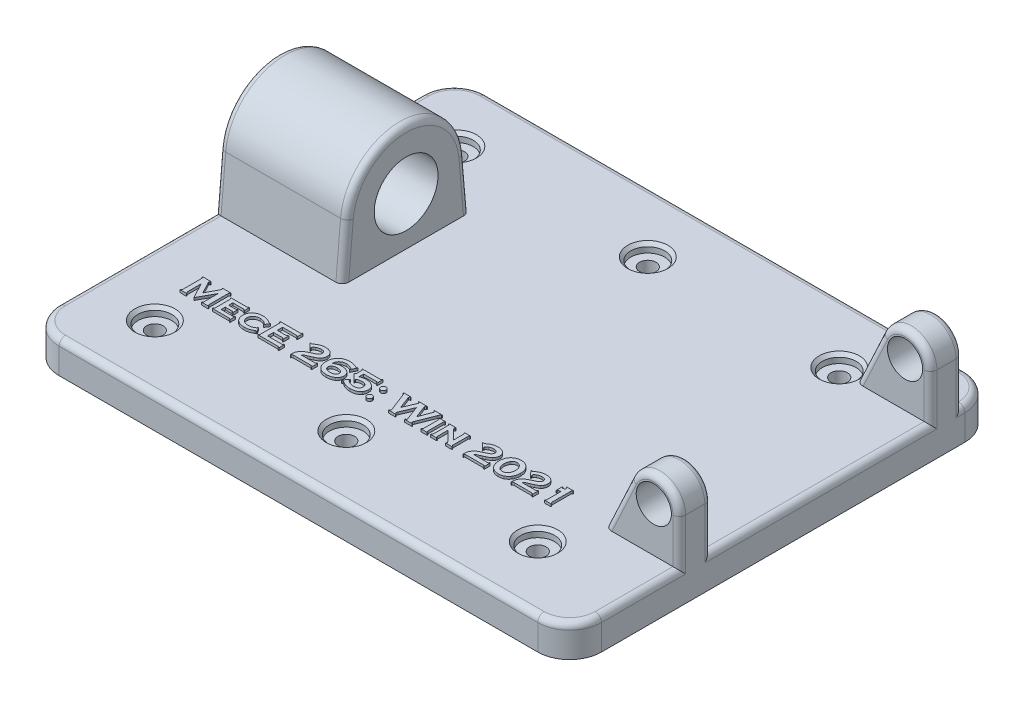
from build123d import *

# Parameters (mm, degrees)
BASE_EXTRUDE_DEPTH         = 50
BASE_EXTRUDE_DEPTH_BACK    = 35
SKETCH1_W                  = 107.95
SKETCH1_H                  = 6.35
LEVER_BOSS_DEPTH           = 3.175
BASE_CORNER_FILLET_R       = 6.35
PLUNGER_BOSS_EXTRUDE_DEPTH = 25.4
PLUNGER_HOLE_D             = 12.7
LPATTERN1_COUNT            = 3
LPATTERN1_PITCH            = 38.1
LPATTERN1_COUNT_DIR2       = 2
LPATTERN1_PITCH_DIR2       = 60
LEVER_BOSS_HOLE_D          = 7
LEVER_BOSS_FILLET_R        = 1.27
BASE_FILLET_R              = 1.27
NAMEPLATE_DEPTH            = 0.5


with BuildPart() as part:
    # Sketch1 → Base-Extrude (new, two sides: drawn at the far end of the back side and taken through both)
    with BuildSketch(Plane.XY.offset(-BASE_EXTRUDE_DEPTH_BACK)):
        with Locations((53.975, 3.175)):
            Rectangle(SKETCH1_W, SKETCH1_H)
    extrude(amount=BASE_EXTRUDE_DEPTH + BASE_EXTRUDE_DEPTH_BACK)

    # Sketch2 → Lever boss (add, symmetric)
    with BuildSketch(Plane.XY.offset(25)):
        with BuildLine():
            Line((107.95, 6.35), (107.95, 15.24))
            ThreePointArc((107.95, 15.24), (103.969513239, 20.199583716), (98.265956442, 17.38690077))
            Line((98.265956442, 17.38690077), (93.119365091, 6.35))
            Line((93.119365091, 6.35), (107.95, 6.35))
        make_face()
    lever_boss = extrude(amount=LEVER_BOSS_DEPTH, both=True)

    # Base Corner Fillet
    base_corner_fillet_edges = [part.edges().sort_by_distance(p)[0] for p in [
        (107.95, 3.175, 50),
        (0, 3.175, -35),
        (107.95, 3.175, -35),
        (0, 3.175, 50),
    ]]
    fillet(base_corner_fillet_edges, radius=BASE_CORNER_FILLET_R)

    # Sketch3 → Plunger-Boss-Extrude (add)
    with BuildSketch(Plane.ZY):
        with BuildLine():
            Line((12.7, 6.35), (11.776529785, 16.905312852))
            ThreePointArc((11.776529785, 16.905312852), (0, 27.696514216), (-11.776529785, 16.905312852))
            Line((-11.776529785, 16.905312852), (-12.7, 6.35))
            Line((-12.7, 6.35), (12.7, 6.35))
        make_face()
    extrude(amount=-PLUNGER_BOSS_EXTRUDE_DEPTH)

    # Plunger-Hole (through all)
    with Locations(Plane(origin=(25.4, 3.190032044, 95.175064019), x_dir=(0, 0, -1), z_dir=(1, 0, 0))):
        with Locations((95.175064019, 12.684967956)):
            Hole(PLUNGER_HOLE_D / 2)

    # Sketch9 → CBORE for #4 Binding Head Machine Screw1 (revolve, cut)
    with BuildSketch(Plane(origin=(88.9, 6.35, 37.3), x_dir=(0, 0, 1), z_dir=(1, 0, 0))):
        Polygon((0, 0), (0, 6.35), (1.63195, 6.35), (1.63195, 1.7272), (3.37312, 1.7272), (3.37312, 0.635), (4.00812, 0), align=None)
    cbore_for_4_binding_head_machine_screw1 = revolve(axis=Axis((88.9, 12.7, 37.3), (0, -1, 0)), mode=Mode.SUBTRACT)

    # LPattern1: CBORE for _4 Binding Head Machine Screw1 3 × 2
    with Locations(*[(-i * LPATTERN1_PITCH, 0, -j * LPATTERN1_PITCH_DIR2) for i in range(LPATTERN1_COUNT) for j in range(LPATTERN1_COUNT_DIR2) if (i, j) != (0, 0)]):
        add(cbore_for_4_binding_head_machine_screw1, mode=Mode.SUBTRACT)

    # Lever Boss Hole (through all)
    with Locations(Plane.XY.offset(28.175)):
        with Locations((102.87, 15.24)):
            lever_boss_hole = Hole(LEVER_BOSS_HOLE_D / 2)

    # Mirror1: Lever boss, Lever Boss Hole across plane
    add(lever_boss.mirror(Plane.XY))
    add(lever_boss_hole.mirror(Plane.XY), mode=Mode.SUBTRACT)

    # Lever Boss Fillet
    lever_boss_fillet_edges = [part.edges().sort_by_distance(p)[0] for p in [
        (95.692660766, 11.868450385, -28.175),
        (103.969513239, 20.199583716, -28.175),
        (107.95, 10.795, -28.175),
        (107.95, 10.795, -21.825),
        (103.969513239, 20.199583716, -21.825),
        (95.692660766, 11.868450385, -21.825),
        (107.95, 10.795, 21.825),
        (103.969513239, 20.199583716, 21.825),
        (95.692660766, 11.868450385, 21.825),
        (107.95, 10.795, 28.175),
        (103.969513239, 20.199583716, 28.175),
        (95.692660766, 11.868450385, 28.175),
    ]]
    fillet(lever_boss_fillet_edges, radius=LEVER_BOSS_FILLET_R)

    # Base Fillet
    base_fillet_edges = [part.edges().sort_by_distance(p)[0] for p in [
        (107.95, 6.35, 0),
        (53.975, 6.35, -35),
        (0, 6.35, 28.175),
        (53.975, 6.35, 50),
        (107.95, 6.35, 35.2775),
        (106.090128061, 6.35, -33.140128061),
        (106.090128061, 6.35, 48.140128061),
        (1.859871939, 6.35, 48.140128061),
        (1.859871939, 6.35, -33.140128061),
        (0, 6.35, -20.675),
        (0, 11.627656426, -12.238264893),
        (0, 27.696514216, 0),
        (25.4, 11.627656426, 12.238264893),
        (25.4, 11.627656426, -12.238264893),
        (25.4, 27.696514216, 0),
        (0, 11.627656426, 12.238264893),
    ]]
    fillet(base_fillet_edges, radius=BASE_FILLET_R)

    # Sketch11 → NamePlate (add)
    # profile 1 of 16: a face of its own
    with BuildSketch(Plane(origin=(0, 6.35, 0), x_dir=(1, 0, 0), z_dir=(0, 1, 0))):
        with BuildLine():
            Line((13.147056448, -30), (11.495630787, -26.877286501))
            Line((11.495630787, -26.877286501), (11.495630787, -29.634855765))
            add(Edge.make_bspline(
                [(11.495630787, -29.634855765), (11.496192409, -29.650798272), (11.497254404, -29.680944612), (11.505053122, -29.723240103), (11.517243484, -29.759737541), (11.53565946, -29.790767349), (11.561204445, -29.817200666), (11.595116205, -29.838703836), (11.635475978, -29.860003454), (11.666152392, -29.870006065), (11.682584635, -29.875364101)],
                knots=[0, 0, 0, 0, 1.143805672, 2.162869084, 3.076607517, 3.891751699, 4.732144596, 5.688553646, 6.761841993, 8, 8, 8, 8], degree=3))
            Line((11.682584635, -29.875364101), (11.682584635, -30))
            Line((11.682584635, -30), (10.436225646, -30))
            Line((10.436225646, -30), (10.436225646, -29.875364101))
            add(Edge.make_bspline(
                [(10.436225646, -29.875364101), (10.45255301, -29.869810603), (10.483173011, -29.859395687), (10.524689532, -29.840499954), (10.557256765, -29.817708439), (10.58357104, -29.792771387), (10.601219453, -29.761405982), (10.615215669, -29.725848335), (10.621168243, -29.683393097), (10.62247806, -29.653685791), (10.623179495, -29.637776919)],
                knots=[0, 0, 0, 0, 1.245049627, 2.334940322, 3.277358327, 4.105699642, 4.925380938, 5.852235277, 6.849827876, 8, 8, 8, 8], degree=3))
            Line((10.623179495, -29.637776919), (10.623179495, -25.872409566))
            add(Edge.make_bspline(
                [(10.623179495, -25.872409566), (10.622483399, -25.856821897), (10.621185292, -25.827753403), (10.615184298, -25.786287805), (10.601335201, -25.751559071), (10.582950813, -25.721165088), (10.557677362, -25.69532113), (10.524614409, -25.672676675), (10.483196232, -25.653690626), (10.452561086, -25.643289619), (10.436225646, -25.637743538)],
                knots=[0, 0, 0, 0, 1.136968202, 2.120262576, 3.033418443, 3.84032541, 4.69303108, 5.643963734, 6.743701478, 8, 8, 8, 8], degree=3))
            Line((10.436225646, -25.637743538), (10.436225646, -25.513107639))
            Line((10.436225646, -25.513107639), (12.111020538, -25.513107639))
            Line((12.111020538, -25.513107639), (12.111020538, -25.637743538))
            add(Edge.make_bspline(
                [(12.111020538, -25.637743538), (12.087908252, -25.644660644), (12.0449694, -25.657511497), (11.994015736, -25.698554022), (11.962725144, -25.753725056), (11.959729951, -25.79505982), (11.958146818, -25.816907643)],
                knots=[0, 0, 0, 0, 1.120256342, 2.081253316, 2.98583099, 4, 4, 4, 4], degree=3))
            add(Edge.make_bspline(
                [(11.958146818, -25.816907643), (11.960873132, -25.840611763), (11.966915006, -25.893143243), (11.990174101, -25.940740546), (12.002937844, -25.966860208)],
                knots=[0, 0, 0, 0, 0.902472994, 2, 2, 2, 2], degree=3))
            Line((12.002937844, -25.966860208), (13.214242987, -28.273598056))
            Line((13.214242987, -28.273598056), (14.441127617, -26.005808927))
            add(Edge.make_bspline(
                [(14.441127617, -26.005808927), (14.453541581, -25.982622181), (14.476124321, -25.940442244), (14.501426736, -25.880483055), (14.519095002, -25.831193972), (14.521769903, -25.800774417), (14.522919926, -25.787696104)],
                knots=[0, 0, 0, 0, 1.343452022, 2.443927349, 3.33099593, 4, 4, 4, 4], degree=3))
            add(Edge.make_bspline(
                [(14.522919926, -25.787696104), (14.521593105, -25.767313553), (14.519063498, -25.728453858), (14.483560958, -25.679265249), (14.42792105, -25.647670081), (14.383833537, -25.641289212), (14.359335308, -25.637743538)],
                knots=[0, 0, 0, 0, 0.973072694, 1.855180349, 2.808182227, 4, 4, 4, 4], degree=3))
            Line((14.359335308, -25.637743538), (14.359335308, -25.513107639))
            Line((14.359335308, -25.513107639), (16.044841098, -25.513107639))
            Line((16.044841098, -25.513107639), (16.044841098, -25.637743538))
            add(Edge.make_bspline(
                [(16.044841098, -25.637743538), (16.028462004, -25.643209504), (15.998022643, -25.653367606), (15.957138276, -25.673267995), (15.923447717, -25.694962728), (15.898233054, -25.721233399), (15.879438486, -25.751333598), (15.867462947, -25.786642047), (15.859402781, -25.827586177), (15.85841557, -25.85678393), (15.857887249, -25.872409566)],
                knots=[0, 0, 0, 0, 1.257218487, 2.336449589, 3.307581813, 4.160911905, 4.968409755, 5.873928041, 6.862199216, 8, 8, 8, 8], degree=3))
            Line((15.857887249, -25.872409566), (15.857887249, -29.637776919))
            add(Edge.make_bspline(
                [(15.857887249, -29.637776919), (15.858421084, -29.653722814), (15.859419848, -29.683556351), (15.867436657, -29.725501497), (15.879547399, -29.761629135), (15.89760967, -29.792704218), (15.923877465, -29.818057295), (15.957064189, -29.839907417), (15.998045715, -29.859718926), (16.028470075, -29.869890751), (16.044841098, -29.875364101)],
                knots=[0, 0, 0, 0, 1.150992626, 2.15341815, 3.072897939, 3.893163974, 4.722096206, 5.684514728, 6.754062187, 8, 8, 8, 8], degree=3))
            Line((16.044841098, -29.875364101), (16.044841098, -30))
            Line((16.044841098, -30), (14.673846209, -30))
            Line((14.673846209, -30), (14.673846209, -29.875364101))
            add(Edge.make_bspline(
                [(14.673846209, -29.875364101), (14.689898842, -29.870240832), (14.720070548, -29.860611399), (14.760467656, -29.841102953), (14.793369189, -29.818791612), (14.819113316, -29.792383779), (14.837906258, -29.760973232), (14.851832474, -29.724143863), (14.858986209, -29.681215473), (14.860176951, -29.6507816), (14.860800058, -29.634855765)],
                knots=[0, 0, 0, 0, 1.207890158, 2.270288398, 3.207074764, 4.047095391, 4.893868447, 5.81518415, 6.856700999, 8, 8, 8, 8], degree=3))
            Line((14.860800058, -29.634855765), (14.860800058, -26.877286501))
            Line((14.860800058, -26.877286501), (13.147056448, -30))
        make_face()
    # profile 2 of 16: a face of its own
    with BuildSketch(Plane(origin=(0, 6.35, 0), x_dir=(1, 0, 0), z_dir=(0, 1, 0))):
        with BuildLine():
            Line((17.914379581, -28.504369213), (17.914379581, -29.314502556))
            Line((17.914379581, -29.314502556), (20.172431531, -29.314502556))
            add(Edge.make_bspline(
                [(20.172431531, -29.314502556), (20.188032939, -29.313842331), (20.21712705, -29.312611119), (20.258311253, -29.306188033), (20.293493093, -29.293854773), (20.323616832, -29.275151956), (20.349853237, -29.24989833), (20.371842068, -29.21603249), (20.391215031, -29.17456502), (20.401573931, -29.14390005), (20.40709756, -29.127548708)],
                knots=[0, 0, 0, 0, 1.135380266, 2.11730133, 3.020893247, 3.826673255, 4.678188001, 5.647254271, 6.745456076, 8, 8, 8, 8], degree=3))
            Line((20.40709756, -29.127548708), (20.531733459, -29.127548708))
            Line((20.531733459, -29.127548708), (20.531733459, -30.186953848))
            Line((20.531733459, -30.186953848), (20.40709756, -30.186953848))
            add(Edge.make_bspline(
                [(20.40709756, -30.186953848), (20.402378894, -30.17087322), (20.393484237, -30.140561334), (20.373755484, -30.100362143), (20.351535765, -30.067383007), (20.325199521, -30.042027943), (20.294517069, -30.022585997), (20.258376245, -30.00932961), (20.216566119, -30.00166637), (20.187071643, -30.000576799), (20.171457813, -30)],
                knots=[0, 0, 0, 0, 1.215074899, 2.290408738, 3.23860127, 4.08884986, 4.925925716, 5.858459218, 6.866307983, 8, 8, 8, 8], degree=3))
            Line((20.171457813, -30), (16.854974441, -30))
            Line((16.854974441, -30), (16.854974441, -29.875364101))
            add(Edge.make_bspline(
                [(16.854974441, -29.875364101), (16.871027121, -29.87024084), (16.901198915, -29.860611421), (16.94159544, -29.84110288), (16.974498817, -29.818791841), (17.000236893, -29.792383016), (17.019052739, -29.760976223), (17.032656336, -29.724731434), (17.040305283, -29.682554165), (17.041362963, -29.65273918), (17.041928289, -29.636803201)],
                knots=[0, 0, 0, 0, 1.214843906, 2.283358307, 3.225537693, 4.070394267, 4.922042142, 5.848661802, 6.850119099, 8, 8, 8, 8], degree=3))
            Line((17.041928289, -29.636803201), (17.041928289, -26.686437781))
            add(Edge.make_bspline(
                [(17.041928289, -26.686437781), (17.041155261, -26.670870541), (17.039681979, -26.641201585), (17.034516508, -26.59914258), (17.019467319, -26.564308957), (17.002401064, -26.533331205), (16.975727061, -26.508492045), (16.943587445, -26.484615578), (16.901970177, -26.4647925), (16.871304308, -26.453754644), (16.854974441, -26.447876881)],
                knots=[0, 0, 0, 0, 1.128472171, 2.1507081, 3.035212659, 3.856119256, 4.685698818, 5.643135706, 6.74494729, 8, 8, 8, 8], degree=3))
            Line((16.854974441, -26.447876881), (16.854974441, -26.323240982))
            Line((16.854974441, -26.323240982), (20.045848197, -26.323240982))
            add(Edge.make_bspline(
                [(20.045848197, -26.323240982), (20.061790591, -26.322693953), (20.091617577, -26.321670504), (20.13330405, -26.313872635), (20.169017689, -26.301396396), (20.199830421, -26.283237503), (20.22619842, -26.257637285), (20.247874606, -26.223988856), (20.26796247, -26.183268104), (20.277398736, -26.152692266), (20.282461661, -26.136287133)],
                knots=[0, 0, 0, 0, 1.152879069, 2.156947538, 3.05581166, 3.877422087, 4.724481516, 5.688477414, 6.75977783, 8, 8, 8, 8], degree=3))
            Line((20.282461661, -26.136287133), (20.40709756, -26.136287133))
            Line((20.40709756, -26.136287133), (20.40709756, -27.195692274))
            Line((20.40709756, -27.195692274), (20.282461661, -27.195692274))
            add(Edge.make_bspline(
                [(20.282461661, -27.195692274), (20.277318628, -27.179330897), (20.267645331, -27.148557522), (20.248467715, -27.107301525), (20.22583768, -27.074290706), (20.199909953, -27.048596738), (20.169014585, -27.031136974), (20.13409655, -27.016170314), (20.092064219, -27.010978763), (20.062391257, -27.009509399), (20.046821914, -27.008738426)],
                knots=[0, 0, 0, 0, 1.242738905, 2.33741155, 3.283964462, 4.132742797, 4.956020487, 5.843079834, 6.86826837, 8, 8, 8, 8], degree=3))
            Line((20.046821914, -27.008738426), (17.914379581, -27.008738426))
            Line((17.914379581, -27.008738426), (17.914379581, -27.818871769))
            Line((17.914379581, -27.818871769), (19.237662289, -27.818871769))
            add(Edge.make_bspline(
                [(19.237662289, -27.818871769), (19.252956333, -27.818309659), (19.281815984, -27.817248964), (19.322206809, -27.809498543), (19.357025035, -27.797075719), (19.386888318, -27.778543156), (19.41320442, -27.753327978), (19.434731356, -27.719392154), (19.455848725, -27.678855755), (19.466568678, -27.648322757), (19.472328318, -27.631917921)],
                knots=[0, 0, 0, 0, 1.117968148, 2.109590653, 2.995889218, 3.806125379, 4.662349203, 5.636774639, 6.730281088, 8, 8, 8, 8], degree=3))
            Line((19.472328318, -27.631917921), (19.596964217, -27.631917921))
            Line((19.596964217, -27.631917921), (19.596964217, -28.691323061))
            Line((19.596964217, -28.691323061), (19.472328318, -28.691323061))
            add(Edge.make_bspline(
                [(19.472328318, -28.691323061), (19.467221015, -28.675260613), (19.457621589, -28.645070459), (19.437798547, -28.604553127), (19.416049085, -28.571261683), (19.390371743, -28.545161519), (19.360362307, -28.52631518), (19.324539839, -28.513452728), (19.283076687, -28.506121758), (19.253271665, -28.50497158), (19.237662289, -28.504369213)],
                knots=[0, 0, 0, 0, 1.225527933, 2.303439456, 3.273384274, 4.108798913, 4.947881325, 5.830104499, 6.863590408, 8, 8, 8, 8], degree=3))
            Line((19.237662289, -28.504369213), (17.914379581, -28.504369213))
        make_face()
    # profile 3 of 16: a face of its own
    with BuildSketch(Plane(origin=(0, 6.35, 0), x_dir=(1, 0, 0), z_dir=(0, 1, 0))):
        with BuildLine():
            Line((24.70800979, -28.673796138), (25.267897618, -29.501456404))
            Line((25.267897618, -29.501456404), (25.191947617, -29.555010892))
            add(Edge.make_bspline(
                [(25.191947617, -29.555010892), (25.179784855, -29.546902715), (25.157335054, -29.531936791), (25.123817252, -29.5157146), (25.094798823, -29.503210191), (25.075845794, -29.502000912), (25.067311718, -29.501456404)],
                knots=[0, 0, 0, 0, 1.274267171, 2.352018912, 3.257955252, 4, 4, 4, 4], degree=3))
            add(Edge.make_bspline(
                [(25.067311718, -29.501456404), (25.054854032, -29.503279966), (25.022279973, -29.508048173), (24.967121727, -29.533699306), (24.89254411, -29.569253277), (24.837976465, -29.600038557), (24.807329022, -29.617328842)],
                knots=[0, 0, 0, 0, 0.525952648, 1.375248384, 2.525831133, 4, 4, 4, 4], degree=3))
            add(Edge.make_bspline(
                [(24.807329022, -29.617328842), (24.734676897, -29.656683612), (24.595498128, -29.732075055), (24.389782802, -29.828738585), (24.197415709, -29.906424343), (24.013894305, -29.967107157), (23.829857256, -30.010989695), (23.63705624, -30.040421459), (23.431202085, -30.059521997), (23.28934795, -30.061367346), (23.216273875, -30.062317949)],
                knots=[0, 0, 0, 0, 1.184599885, 2.269323209, 3.257144768, 4.157868905, 5.038358213, 5.9664884, 6.952466352, 8, 8, 8, 8], degree=3))
            add(Edge.make_bspline(
                [(23.216273875, -30.062317949), (23.142882244, -30.060954488), (22.999403318, -30.058288954), (22.789065663, -30.039051106), (22.58935176, -30.004780757), (22.399838363, -29.958252828), (22.220479831, -29.898906263), (22.051674879, -29.82570306), (21.892550775, -29.739561694), (21.795291459, -29.670277867), (21.746933473, -29.635829483)],
                knots=[0, 0, 0, 0, 1.131297534, 2.211660286, 3.252187004, 4.252104599, 5.217243932, 6.160662488, 7.085469028, 8, 8, 8, 8], degree=3))
            add(Edge.make_bspline(
                [(21.746933473, -29.635829483), (21.694792565, -29.593937323), (21.590657508, -29.510270915), (21.455660785, -29.361836769), (21.331819408, -29.202328194), (21.266679648, -29.084059981), (21.233784108, -29.024334604)],
                knots=[0, 0, 0, 0, 0.996063148, 1.989322702, 2.984609174, 4, 4, 4, 4], degree=3))
            add(Edge.make_bspline(
                [(21.233784108, -29.024334604), (21.20253425, -28.957499337), (21.139933148, -28.823611967), (21.076891303, -28.610279091), (21.03718825, -28.388690172), (21.032603868, -28.238068753), (21.030277054, -28.161620491)],
                knots=[0, 0, 0, 0, 0.988698811, 1.980605282, 2.975051361, 4, 4, 4, 4], degree=3))
            add(Edge.make_bspline(
                [(21.030277054, -28.161620491), (21.031362881, -28.108988696), (21.03350719, -28.00505058), (21.051685782, -27.85138055), (21.080602785, -27.702182397), (21.121739106, -27.557600402), (21.174141722, -27.417521216), (21.240195962, -27.283285896), (21.315939243, -27.152540657), (21.375221564, -27.070577151), (21.405158469, -27.029186503)],
                knots=[0, 0, 0, 0, 1.039477079, 2.052776036, 3.052513079, 4.038981114, 5.019114381, 6.002765034, 6.991418816, 8, 8, 8, 8], degree=3))
            add(Edge.make_bspline(
                [(21.405158469, -27.029186503), (21.430023088, -26.997644073), (21.479350928, -26.935068413), (21.560963815, -26.848404876), (21.646686708, -26.767300932), (21.737484881, -26.692219949), (21.833261796, -26.62269326), (21.934154278, -26.559616972), (22.040268226, -26.503249513), (22.150217672, -26.45084822), (22.266148964, -26.406843901), (22.386304593, -26.367539208), (22.511479585, -26.334492329), (22.641427507, -26.307111597), (22.776794046, -26.287247643), (22.916368612, -26.271205158), (23.061343239, -26.26260188), (23.159463578, -26.261489707), (23.20945785, -26.260923032)],
                knots=[0, 0, 0, 0, 0.946395875, 1.877513725, 2.803050776, 3.726846816, 4.65276329, 5.59111463, 6.529060373, 7.484015518, 8.460160452, 9.449765982, 10.463075024, 11.510473448, 12.578488389, 13.687035187, 14.821498245, 16, 16, 16, 16], degree=3))
            add(Edge.make_bspline(
                [(23.20945785, -26.260923032), (23.282523907, -26.262281266), (23.424706663, -26.264924319), (23.631854762, -26.283955259), (23.826066574, -26.318309141), (24.012378806, -26.365605505), (24.198040657, -26.432389772), (24.391408547, -26.518992541), (24.597767313, -26.625011066), (24.735474255, -26.708885407), (24.807329022, -26.752650602)],
                knots=[0, 0, 0, 0, 1.032739721, 2.009657924, 2.936630111, 3.817905152, 4.723352432, 5.721593305, 6.811139228, 8, 8, 8, 8], degree=3))
            add(Edge.make_bspline(
                [(24.807329022, -26.752650602), (24.837983994, -26.771513942), (24.892533026, -26.805080337), (24.966808499, -26.844851225), (25.022091178, -26.872418854), (25.054841953, -26.878059859), (25.067311718, -26.880207655)],
                knots=[0, 0, 0, 0, 1.481453336, 2.636174134, 3.480727184, 4, 4, 4, 4], degree=3))
            add(Edge.make_bspline(
                [(25.067311718, -26.880207655), (25.075825449, -26.879243501), (25.094680589, -26.877108215), (25.124303735, -26.865341826), (25.157245778, -26.846421579), (25.17975404, -26.830441559), (25.191947617, -26.821784578)],
                knots=[0, 0, 0, 0, 0.734539231, 1.626765118, 2.714328907, 4, 4, 4, 4], degree=3))
            Line((25.191947617, -26.821784578), (25.267897618, -26.884102527))
            Line((25.267897618, -26.884102527), (24.70800979, -27.68936728))
            Line((24.70800979, -27.68936728), (24.634980943, -27.633865356))
            add(Edge.make_bspline(
                [(24.634980943, -27.633865356), (24.636122386, -27.622483978), (24.637887087, -27.604888047), (24.640776487, -27.587445106), (24.641796969, -27.581284587)],
                knots=[0, 0, 0, 0, 1.293637571, 2, 2, 2, 2], degree=3))
            add(Edge.make_bspline(
                [(24.641796969, -27.581284587), (24.642912964, -27.572208119), (24.6447434, -27.557321038), (24.645425578, -27.542340609), (24.645691841, -27.53649356)],
                knots=[0, 0, 0, 0, 1.21937509, 2, 2, 2, 2], degree=3))
            add(Edge.make_bspline(
                [(24.645691841, -27.53649356), (24.644281513, -27.521976874), (24.641257099, -27.4908462), (24.616979863, -27.445455042), (24.581527967, -27.398621111), (24.531671618, -27.350728848), (24.467867644, -27.302543793), (24.390283913, -27.253208068), (24.299388543, -27.201345942), (24.233022637, -27.168397336), (24.197781579, -27.150901248)],
                knots=[0, 0, 0, 0, 0.565910363, 1.213580787, 1.97569251, 2.864913576, 3.906543711, 5.100924053, 6.460557377, 8, 8, 8, 8], degree=3))
            add(Edge.make_bspline(
                [(24.197781579, -27.150901248), (24.127647402, -27.119418358), (23.989717292, -27.057502204), (23.775175168, -26.993809447), (23.559885336, -26.953720003), (23.415733928, -26.948849762), (23.343830928, -26.946420476)],
                knots=[0, 0, 0, 0, 1.041022806, 2.047338354, 3.02600861, 4, 4, 4, 4], degree=3))
            add(Edge.make_bspline(
                [(23.343830928, -26.946420476), (23.294782901, -26.947322325), (23.198410367, -26.949094332), (23.057148294, -26.963999553), (22.922301799, -26.988062407), (22.794308248, -27.022255864), (22.672672257, -27.065698661), (22.558691041, -27.121263535), (22.449578329, -27.183699453), (22.382934015, -27.233915753), (22.349664891, -27.258983942)],
                knots=[0, 0, 0, 0, 1.107669688, 2.1764165, 3.204637584, 4.198757999, 5.165882684, 6.116866008, 7.059931545, 8, 8, 8, 8], degree=3))
            add(Edge.make_bspline(
                [(22.349664891, -27.258983942), (22.313889104, -27.288716724), (22.243990881, -27.346808212), (22.153234485, -27.445456804), (22.075027024, -27.548869019), (22.012686813, -27.659867646), (21.963494554, -27.776466155), (21.928464048, -27.899363084), (21.90622217, -28.028386656), (21.903905324, -28.116737502), (21.902728347, -28.161620491)],
                knots=[0, 0, 0, 0, 1.067536204, 2.085737057, 3.071424276, 4.039699579, 5.002100908, 5.971982452, 6.969749656, 8, 8, 8, 8], degree=3))
            add(Edge.make_bspline(
                [(21.902728347, -28.161620491), (21.90388315, -28.20683056), (21.90614832, -28.295511055), (21.928586393, -28.42514545), (21.963511749, -28.548688141), (22.012444743, -28.666075151), (22.07505295, -28.777281537), (22.153227273, -28.880708553), (22.243992811, -28.979353061), (22.313889758, -29.03744512), (22.349664891, -29.067178194)],
                knots=[0, 0, 0, 0, 1.03491658, 2.03001051, 3.004441245, 3.971123812, 4.936804857, 5.919851167, 6.935323999, 8, 8, 8, 8], degree=3))
            add(Edge.make_bspline(
                [(22.349664891, -29.067178194), (22.383242851, -29.092280991), (22.450163, -29.142310322), (22.559717554, -29.203884579), (22.673912644, -29.258825361), (22.796194078, -29.30056352), (22.923912726, -29.335156935), (23.058121638, -29.35923423), (23.198729764, -29.374185054), (23.294781714, -29.375929631), (23.343830928, -29.376820505)],
                knots=[0, 0, 0, 0, 0.947320047, 1.887988345, 2.837127321, 3.81001842, 4.805500019, 5.827905819, 6.890813653, 8, 8, 8, 8], degree=3))
            add(Edge.make_bspline(
                [(23.343830928, -29.376820505), (23.4222616, -29.373989564), (23.580324383, -29.368284316), (23.816203106, -29.321974666), (24.05215848, -29.249488639), (24.2033852, -29.179062602), (24.280547606, -29.143128195)],
                knots=[0, 0, 0, 0, 0.96582566, 1.946446298, 2.952188178, 4, 4, 4, 4], degree=3))
            add(Edge.make_bspline(
                [(24.280547606, -29.143128195), (24.309270089, -29.128160135), (24.363421036, -29.099940617), (24.437595473, -29.05570186), (24.501326632, -29.014809887), (24.552749121, -28.97350041), (24.592830677, -28.933595263), (24.623462091, -28.896034141), (24.641430991, -28.857973796), (24.644335157, -28.832655168), (24.645691841, -28.82082755)],
                knots=[0, 0, 0, 0, 1.540234879, 2.903828908, 4.10705529, 5.139024012, 6.034200788, 6.793839951, 7.436541332, 8, 8, 8, 8], degree=3))
            add(Edge.make_bspline(
                [(24.645691841, -28.82082755), (24.645359362, -28.818231877), (24.644239012, -28.809485287), (24.642505889, -28.791609425), (24.639582225, -28.763657702), (24.63667496, -28.741947974), (24.634980943, -28.729298062)],
                knots=[0, 0, 0, 0, 0.340730668, 1.148153413, 2.338274473, 4, 4, 4, 4], degree=3))
            Line((24.634980943, -28.729298062), (24.70800979, -28.673796138))
        make_face()
    # profile 4 of 16: a face of its own
    with BuildSketch(Plane(origin=(0, 6.35, 0), x_dir=(1, 0, 0), z_dir=(0, 1, 0))):
        with BuildLine():
            Line((27.075118152, -28.068143567), (27.075118152, -29.252184606))
            Line((27.075118152, -29.252184606), (29.896952801, -29.252184606))
            add(Edge.make_bspline(
                [(29.896952801, -29.252184606), (29.912245115, -29.251620768), (29.941101504, -29.250556813), (29.981513924, -29.242827974), (30.016262389, -29.230335432), (30.046163514, -29.212161906), (30.071412796, -29.186226044), (30.093234042, -29.152997634), (30.113054665, -29.112029265), (30.123225083, -29.081602873), (30.128697676, -29.065230758)],
                knots=[0, 0, 0, 0, 1.122993917, 2.119074212, 3.009357088, 3.823235625, 4.666282338, 5.645088255, 6.732847224, 8, 8, 8, 8], degree=3))
            Line((30.128697676, -29.065230758), (30.253333574, -29.065230758))
            Line((30.253333574, -29.065230758), (30.253333574, -30.186953848))
            Line((30.253333574, -30.186953848), (30.128697676, -30.186953848))
            add(Edge.make_bspline(
                [(30.128697676, -30.186953848), (30.123144999, -30.170625178), (30.112731623, -30.140002726), (30.093825889, -30.098502118), (30.071065237, -30.065885777), (30.046223118, -30.039929945), (30.015803656, -30.021898408), (29.981143104, -30.007977416), (29.939978672, -30.002051998), (29.911239942, -30.000711717), (29.895979083, -30)],
                knots=[0, 0, 0, 0, 1.262686781, 2.368016675, 3.323784808, 4.16386026, 4.974870337, 5.892669588, 6.880963999, 8, 8, 8, 8], degree=3))
            Line((29.895979083, -30), (25.891077112, -30))
            Line((25.891077112, -30), (25.891077112, -29.875364101))
            add(Edge.make_bspline(
                [(25.891077112, -29.875364101), (25.907404476, -29.869810603), (25.938024477, -29.859395687), (25.979540998, -29.840499954), (26.012108231, -29.817708439), (26.038422506, -29.792771387), (26.056070919, -29.761405982), (26.070067136, -29.725848335), (26.076019709, -29.683393097), (26.077329526, -29.653685791), (26.078030961, -29.637776919)],
                knots=[0, 0, 0, 0, 1.245049627, 2.334940322, 3.277358327, 4.105699642, 4.925380938, 5.852235277, 6.849827876, 8, 8, 8, 8], degree=3))
            Line((26.078030961, -29.637776919), (26.078030961, -25.87533072))
            add(Edge.make_bspline(
                [(26.078030961, -25.87533072), (26.077315086, -25.859426133), (26.075978305, -25.829726829), (26.070244458, -25.787521301), (26.055884726, -25.752390838), (26.038146196, -25.721276717), (26.01248355, -25.695347998), (25.979480655, -25.672667905), (25.93804313, -25.653693337), (25.907410963, -25.643290562), (25.891077112, -25.637743538)],
                knots=[0, 0, 0, 0, 1.150912396, 2.149147064, 3.054708998, 3.874917856, 4.720532304, 5.663556867, 6.754149036, 8, 8, 8, 8], degree=3))
            Line((25.891077112, -25.637743538), (25.891077112, -25.513107639))
            Line((25.891077112, -25.513107639), (29.832687416, -25.513107639))
            add(Edge.make_bspline(
                [(29.832687416, -25.513107639), (29.847992191, -25.512568892), (29.876872093, -25.511552284), (29.917428397, -25.50345021), (29.953128885, -25.491769078), (29.982589981, -25.471638918), (30.009211809, -25.446657348), (30.030852281, -25.412861205), (30.050564417, -25.372259042), (30.060876609, -25.342196638), (30.066379726, -25.326153791)],
                knots=[0, 0, 0, 0, 1.118821989, 2.11120184, 3.020484762, 3.844115329, 4.700993089, 5.676162735, 6.759880674, 8, 8, 8, 8], degree=3))
            Line((30.066379726, -25.326153791), (30.191015625, -25.326153791))
            Line((30.191015625, -25.326153791), (30.191015625, -26.447876881))
            Line((30.191015625, -26.447876881), (30.066379726, -26.447876881))
            add(Edge.make_bspline(
                [(30.066379726, -26.447876881), (30.060792616, -26.431882121), (30.050226615, -26.401633809), (30.031501696, -26.36043024), (30.008806952, -26.327672332), (29.983581774, -26.302058019), (29.954040196, -26.282321291), (29.918421145, -26.270562257), (29.877840145, -26.262483807), (29.848963946, -26.261463657), (29.833661134, -26.260923032)],
                knots=[0, 0, 0, 0, 1.242471745, 2.349686581, 3.307084604, 4.148592654, 4.97378559, 5.884793359, 6.879055685, 8, 8, 8, 8], degree=3))
            Line((29.833661134, -26.260923032), (27.075118152, -26.260923032))
            Line((27.075118152, -26.260923032), (27.075118152, -27.320328173))
            Line((27.075118152, -27.320328173), (28.839495096, -27.320328173))
            add(Edge.make_bspline(
                [(28.839495096, -27.320328173), (28.854793717, -27.319795892), (28.883343322, -27.318802573), (28.923370709, -27.310816068), (28.95784809, -27.298499388), (28.987679251, -27.280267983), (29.013071828, -27.254643603), (29.033632299, -27.220797052), (29.053735561, -27.180229944), (29.063850041, -27.14976642), (29.069292535, -27.133374325)],
                knots=[0, 0, 0, 0, 1.128148349, 2.105300297, 2.999669483, 3.817283642, 4.664199857, 5.634279442, 6.727031118, 8, 8, 8, 8], degree=3))
            Line((29.069292535, -27.133374325), (29.193928434, -27.133374325))
            Line((29.193928434, -27.133374325), (29.193928434, -28.255097415))
            Line((29.193928434, -28.255097415), (29.069292535, -28.255097415))
            add(Edge.make_bspline(
                [(29.069292535, -28.255097415), (29.063790604, -28.239056677), (29.053480637, -28.208998227), (29.033951035, -28.168776114), (29.012792489, -28.135605759), (28.987445306, -28.110196893), (28.957963538, -28.090970325), (28.923566349, -28.07742284), (28.88331873, -28.06974719), (28.854785137, -28.06870307), (28.839495096, -28.068143567)],
                knots=[0, 0, 0, 0, 1.253752986, 2.349385135, 3.301946776, 4.151095445, 4.983780867, 5.889150171, 6.868877873, 8, 8, 8, 8], degree=3))
            Line((28.839495096, -28.068143567), (27.075118152, -28.068143567))
        make_face()
    # profile 5 of 16: a face of its own
    with BuildSketch(Plane(origin=(0, 6.35, 0), x_dir=(1, 0, 0), z_dir=(0, 1, 0))):
        with BuildLine():
            Line((33.729506693, -29.189866657), (36.435468904, -29.189866657))
            add(Edge.make_bspline(
                [(36.435468904, -29.189866657), (36.451074555, -29.189257318), (36.480872466, -29.188093827), (36.522382915, -29.180851397), (36.557895741, -29.167769098), (36.588488674, -29.149890002), (36.61483267, -29.124251352), (36.636567507, -29.090632878), (36.656455312, -29.049725892), (36.666615357, -29.019290023), (36.672082369, -29.002912809)],
                knots=[0, 0, 0, 0, 1.13151245, 2.160544746, 3.038966146, 3.862084393, 4.710698347, 5.676463371, 6.749729838, 8, 8, 8, 8], degree=3))
            Line((36.672082369, -29.002912809), (36.796718268, -29.002912809))
            Line((36.796718268, -29.002912809), (36.796718268, -30.186953848))
            Line((36.796718268, -30.186953848), (36.672082369, -30.186953848))
            add(Edge.make_bspline(
                [(36.672082369, -30.186953848), (36.666535236, -30.170620289), (36.656132256, -30.139988671), (36.637159015, -30.098547589), (36.614474805, -30.065555733), (36.588559372, -30.039857462), (36.55766088, -30.022398792), (36.522743764, -30.007431809), (36.480711143, -30.00224036), (36.451038224, -30.000770981), (36.435468904, -30)],
                knots=[0, 0, 0, 0, 1.249298427, 2.342908433, 3.288542492, 4.136496886, 4.95897539, 5.845173635, 6.869366984, 8, 8, 8, 8], degree=3))
            Line((36.435468904, -30), (32.994349633, -30))
            add(Edge.make_bspline(
                [(32.994349633, -30), (32.969029847, -30.00068195), (32.922826396, -30.001926371), (32.85990754, -30.007593931), (32.810261434, -30.019981163), (32.770957645, -30.037529846), (32.74119315, -30.06582745), (32.71860714, -30.104237543), (32.697580125, -30.152814955), (32.688627685, -30.189996716), (32.683733603, -30.210323079)],
                knots=[0, 0, 0, 0, 1.432247648, 2.613560139, 3.561491334, 4.316463617, 5.017561985, 5.842228221, 6.82039873, 8, 8, 8, 8], degree=3))
            Line((32.683733603, -30.210323079), (32.559097704, -30.210323079))
            add(Edge.make_bspline(
                [(32.559097704, -30.210323079), (32.558768912, -30.185331048), (32.558175366, -30.140214642), (32.557440275, -30.080164847), (32.556003559, -30.035059328), (32.556126901, -30.010062313), (32.556176551, -30)],
                knots=[0, 0, 0, 0, 1.42587833, 2.57404066, 3.425993493, 4, 4, 4, 4], degree=3))
            add(Edge.make_bspline(
                [(32.556176551, -30), (32.55716208, -29.932762826), (32.559046396, -29.804206503), (32.576869903, -29.620717315), (32.604223485, -29.455019231), (32.63500762, -29.353204659), (32.649653475, -29.304765376)],
                knots=[0, 0, 0, 0, 1.145142485, 2.189492793, 3.138633418, 4, 4, 4, 4], degree=3))
            add(Edge.make_bspline(
                [(32.649653475, -29.304765376), (32.666372361, -29.25898959), (32.699685293, -29.167779826), (32.763927415, -29.037293407), (32.837394775, -28.911616843), (32.921068637, -28.791178144), (33.014796825, -28.675620635), (33.119789296, -28.56641835), (33.234634718, -28.461942287), (33.31749943, -28.397689682), (33.359493868, -28.365127545)],
                knots=[0, 0, 0, 0, 0.977371777, 1.947445488, 2.913750716, 3.896662998, 4.887485478, 5.896404827, 6.933933444, 8, 8, 8, 8], degree=3))
            add(Edge.make_bspline(
                [(33.359493868, -28.365127545), (33.383378755, -28.348054311), (33.434000384, -28.3118693), (33.517093527, -28.258686466), (33.610209662, -28.202402862), (33.714144167, -28.143682496), (33.828752251, -28.082962341), (33.953812588, -28.018225477), (34.089542151, -27.951419835), (34.184159537, -27.907001203), (34.232918878, -27.884110872)],
                knots=[0, 0, 0, 0, 0.705580701, 1.495407698, 2.37041235, 3.320641729, 4.364187789, 5.487691257, 6.705327587, 8, 8, 8, 8], degree=3))
            Line((34.232918878, -27.884110872), (34.778200936, -27.629970485))
            add(Edge.make_bspline(
                [(34.778200936, -27.629970485), (34.842327681, -27.600817365), (34.962989497, -27.545962432), (35.125455388, -27.453171955), (35.260070554, -27.360130921), (35.369200751, -27.26528983), (35.450029193, -27.16204233), (35.509888514, -27.052462219), (35.543402257, -26.931789751), (35.548011094, -26.84859334), (35.550359279, -26.80620509)],
                knots=[0, 0, 0, 0, 1.406861248, 2.647170611, 3.732008615, 4.673389594, 5.523132178, 6.338321091, 7.153381024, 8, 8, 8, 8], degree=3))
            add(Edge.make_bspline(
                [(35.550359279, -26.80620509), (35.549904588, -26.782154263), (35.549021853, -26.735461971), (35.539115598, -26.667489685), (35.522251001, -26.604027545), (35.500618251, -26.544332605), (35.470447529, -26.490218286), (35.435271281, -26.439931629), (35.393267558, -26.393828803), (35.343853508, -26.353231115), (35.289630152, -26.315669555), (35.228215739, -26.285071829), (35.162209671, -26.257126758), (35.089388484, -26.236615323), (35.011582245, -26.218320422), (34.927387785, -26.207733303), (34.837778214, -26.199035868), (34.775954093, -26.198751503), (34.744120807, -26.198605083)],
                knots=[0, 0, 0, 0, 1.006239183, 1.953513406, 2.866351355, 3.752093632, 4.603295836, 5.45145647, 6.316960174, 7.20416012, 8.123647236, 9.071603266, 10.07075455, 11.119659267, 12.233765904, 13.413539255, 14.668229452, 16, 16, 16, 16], degree=3))
            add(Edge.make_bspline(
                [(34.744120807, -26.198605083), (34.704505562, -26.199459617), (34.625782148, -26.201157748), (34.508524271, -26.211544722), (34.393547038, -26.231608433), (34.280687436, -26.257743632), (34.169470563, -26.290773591), (34.061165577, -26.332994785), (33.954114629, -26.38138572), (33.885687936, -26.419776167), (33.851221438, -26.439113419)],
                knots=[0, 0, 0, 0, 1.016200025, 2.019392648, 3.015757097, 4.007275404, 4.989664807, 5.988426162, 6.986771077, 8, 8, 8, 8], degree=3))
            add(Edge.make_bspline(
                [(33.851221438, -26.439113419), (33.819787277, -26.457828729), (33.75955604, -26.493689279), (33.677930685, -26.551691638), (33.608700124, -26.610568899), (33.551902892, -26.669690952), (33.50706687, -26.729302524), (33.475402999, -26.78975935), (33.453994264, -26.850862186), (33.452004046, -26.892698839), (33.451023356, -26.913314066)],
                knots=[0, 0, 0, 0, 1.354757515, 2.595861342, 3.70432248, 4.716323467, 5.62769156, 6.455879911, 7.239126832, 8, 8, 8, 8], degree=3))
            add(Edge.make_bspline(
                [(33.451023356, -26.913314066), (33.451646223, -26.92505128), (33.453118166, -26.952788334), (33.465920212, -26.999565126), (33.481845635, -27.059191629), (33.49649958, -27.102618446), (33.504577844, -27.126558299)],
                knots=[0, 0, 0, 0, 0.637998415, 1.507699908, 2.626072539, 4, 4, 4, 4], degree=3))
            Line((33.504577844, -27.126558299), (33.431548997, -27.204455736))
            Line((33.431548997, -27.204455736), (32.559097704, -26.260923032))
            Line((32.559097704, -26.260923032), (32.637968859, -26.186920467))
            add(Edge.make_bspline(
                [(32.637968859, -26.186920467), (32.657301583, -26.196043949), (32.692901569, -26.212844263), (32.743590821, -26.230823163), (32.785320047, -26.244179386), (32.810899526, -26.246349225), (32.822001554, -26.247290981)],
                knots=[0, 0, 0, 0, 1.315671879, 2.422726473, 3.315430407, 4, 4, 4, 4], degree=3))
            add(Edge.make_bspline(
                [(32.822001554, -26.247290981), (32.838728098, -26.246301035), (32.870939434, -26.244394635), (32.910905904, -26.227819441), (32.943540085, -26.203773795), (32.979228018, -26.176201484), (33.02440019, -26.137188698), (33.057708266, -26.107147872), (33.076141941, -26.090522389)],
                knots=[0, 0, 0, 0, 0.980233736, 1.887696472, 2.491331705, 3.361906818, 4.540001151, 6, 6, 6, 6], degree=3))
            add(Edge.make_bspline(
                [(33.076141941, -26.090522389), (33.137143354, -26.039234227), (33.258276596, -25.937389021), (33.456900826, -25.80819992), (33.665012758, -25.697455851), (33.884019992, -25.606516869), (34.113932511, -25.536161454), (34.354281149, -25.487277447), (34.605016284, -25.455781162), (34.775831752, -25.452475125), (34.862914399, -25.450789689)],
                knots=[0, 0, 0, 0, 0.984390242, 1.95474787, 2.922156416, 3.89526397, 4.881386087, 5.889368721, 6.923988799, 8, 8, 8, 8], degree=3))
            add(Edge.make_bspline(
                [(34.862914399, -25.450789689), (34.924952368, -25.451846037), (35.046041111, -25.453907868), (35.223063741, -25.471886571), (35.390493946, -25.500506849), (35.548492632, -25.541565083), (35.696655519, -25.594210851), (35.836004465, -25.657369439), (35.965528208, -25.733197715), (36.043978776, -25.793661934), (36.082983003, -25.823723668)],
                knots=[0, 0, 0, 0, 1.143954202, 2.23282578, 3.278020167, 4.274075251, 5.239714119, 6.174598898, 7.092443025, 8, 8, 8, 8], degree=3))
            add(Edge.make_bspline(
                [(36.082983003, -25.823723668), (36.120180007, -25.855634009), (36.193549225, -25.918575551), (36.287559864, -26.02680462), (36.368912708, -26.141437657), (36.433901336, -26.264762653), (36.485463323, -26.395607608), (36.520646472, -26.534706959), (36.544317435, -26.681410335), (36.546389192, -26.782089649), (36.54744647, -26.833469193)],
                knots=[0, 0, 0, 0, 1.020302833, 2.012496001, 2.979079863, 3.944526623, 4.910636855, 5.903383418, 6.930036374, 8, 8, 8, 8], degree=3))
            add(Edge.make_bspline(
                [(36.54744647, -26.833469193), (36.546159338, -26.884165977), (36.543631928, -26.983714094), (36.523062193, -27.129736769), (36.48746463, -27.268446257), (36.440140907, -27.401146433), (36.37711446, -27.526309918), (36.300408081, -27.645078305), (36.21020246, -27.7573315), (36.140531191, -27.82476872), (36.105378516, -27.858794205)],
                knots=[0, 0, 0, 0, 1.056610711, 2.074758968, 3.065975388, 4.037740125, 5.006059464, 5.980153532, 6.980885406, 8, 8, 8, 8], degree=3))
            add(Edge.make_bspline(
                [(36.105378516, -27.858794205), (36.053628692, -27.903048263), (35.945864018, -27.995203632), (35.76036985, -28.117268757), (35.55244445, -28.236856907), (35.401659945, -28.306581867), (35.323482994, -28.342732032)],
                knots=[0, 0, 0, 0, 0.884359388, 1.841604374, 2.880940795, 4, 4, 4, 4], degree=3))
            Line((35.323482994, -28.342732032), (34.81909709, -28.569608316))
            add(Edge.make_bspline(
                [(34.81909709, -28.569608316), (34.801937596, -28.577815786), (34.759862372, -28.59794057), (34.683179039, -28.630949908), (34.581170899, -28.67213592), (34.504897836, -28.703299895), (34.462716317, -28.7205346)],
                knots=[0, 0, 0, 0, 0.58962826, 1.445773463, 2.5874285, 4, 4, 4, 4], degree=3))
            add(Edge.make_bspline(
                [(34.462716317, -28.7205346), (34.410032553, -28.742359313), (34.31265314, -28.782699592), (34.180248595, -28.841619482), (34.073186054, -28.894178593), (33.987046216, -28.941928865), (33.915628752, -28.992976255), (33.849941911, -29.049536811), (33.787948625, -29.11625373), (33.749303599, -29.164930654), (33.729506693, -29.189866657)],
                knots=[0, 0, 0, 0, 1.548219644, 2.861692299, 3.933619186, 4.786162107, 5.531915926, 6.312817191, 7.135697312, 8, 8, 8, 8], degree=3))
        make_face()
    # profile 6 of 16: a face of its own
    with BuildSketch(Plane(origin=(0, 6.35, 0), x_dir=(1, 0, 0), z_dir=(0, 1, 0))):
        with BuildLine():
            Line((41.595200376, -25.799380719), (41.034338831, -26.885076245))
            Line((41.034338831, -26.885076245), (40.939888189, -26.839311501))
            add(Edge.make_bspline(
                [(40.939888189, -26.839311501), (40.944805383, -26.814403489), (40.953194994, -26.771905974), (40.955491063, -26.728674157), (40.956441394, -26.71078073)],
                knots=[0, 0, 0, 0, 1.172210283, 2, 2, 2, 2], degree=3))
            add(Edge.make_bspline(
                [(40.956441394, -26.71078073), (40.953474611, -26.688166678), (40.947151186, -26.639966918), (40.900985251, -26.572262564), (40.831622195, -26.506442664), (40.772578747, -26.468587491), (40.740276007, -26.447876881)],
                knots=[0, 0, 0, 0, 0.764066703, 1.62853752, 2.702570081, 4, 4, 4, 4], degree=3))
            add(Edge.make_bspline(
                [(40.740276007, -26.447876881), (40.708108864, -26.429775499), (40.641340101, -26.392202784), (40.531206912, -26.345119471), (40.409351196, -26.302083072), (40.277010766, -26.26643707), (40.139950216, -26.236237098), (40.002646988, -26.215408503), (39.86750962, -26.200340457), (39.777959033, -26.199181229), (39.733451636, -26.198605083)],
                knots=[0, 0, 0, 0, 0.844698604, 1.753325772, 2.738271679, 3.802139177, 4.889681312, 5.950350531, 6.981306915, 8, 8, 8, 8], degree=3))
            add(Edge.make_bspline(
                [(39.733451636, -26.198605083), (39.687663917, -26.199704849), (39.597215647, -26.201877307), (39.464000763, -26.21413242), (39.336111934, -26.236664104), (39.213458204, -26.268105861), (39.095724624, -26.30764615), (38.983204419, -26.356827747), (38.875392565, -26.413977591), (38.808048258, -26.459280763), (38.774339445, -26.481957009)],
                knots=[0, 0, 0, 0, 1.081329902, 2.136040401, 3.155406366, 4.144324384, 5.123482661, 6.084567088, 7.04124088, 8, 8, 8, 8], degree=3))
            add(Edge.make_bspline(
                [(38.774339445, -26.481957009), (38.732873152, -26.513371469), (38.651289426, -26.575178505), (38.546188624, -26.684299712), (38.457278683, -26.802202447), (38.384619665, -26.931456188), (38.328037674, -27.076249631), (38.28264647, -27.23866904), (38.248776235, -27.421188123), (38.236465109, -27.549995325), (38.230031105, -27.617312151)],
                knots=[0, 0, 0, 0, 0.954792996, 1.878527463, 2.773209147, 3.662486537, 4.593968145, 5.623003345, 6.757741292, 8, 8, 8, 8], degree=3))
            add(Edge.make_bspline(
                [(38.230031105, -27.617312151), (38.286122129, -27.571272504), (38.395187057, -27.481751749), (38.566689467, -27.366000272), (38.739167092, -27.271268502), (38.91457934, -27.19514888), (39.097963748, -27.139350525), (39.292283966, -27.100007768), (39.499753932, -27.07490097), (39.642496183, -27.072362301), (39.715924713, -27.071056375)],
                knots=[0, 0, 0, 0, 1.073556664, 2.087453099, 3.057012603, 3.982330226, 4.912237494, 5.888249097, 6.913686998, 8, 8, 8, 8], degree=3))
            add(Edge.make_bspline(
                [(39.715924713, -27.071056375), (39.776014249, -27.071779106), (39.894161543, -27.073200131), (40.06777247, -27.090703341), (40.234598618, -27.116751817), (40.395334595, -27.152320425), (40.549008089, -27.200489474), (40.69666163, -27.257788272), (40.83788884, -27.325885489), (40.926670008, -27.379959996), (40.971047164, -27.406989072)],
                knots=[0, 0, 0, 0, 1.094437242, 2.151868804, 3.175642452, 4.169868347, 5.148137369, 6.106852939, 7.053712801, 8, 8, 8, 8], degree=3))
            add(Edge.make_bspline(
                [(40.971047164, -27.406989072), (41.018093944, -27.439211068), (41.111816831, -27.503401188), (41.234949604, -27.620940313), (41.345509577, -27.751114817), (41.40463539, -27.848495086), (41.434536913, -27.897742924)],
                knots=[0, 0, 0, 0, 1.002492279, 1.997086095, 2.987072238, 4, 4, 4, 4], degree=3))
            add(Edge.make_bspline(
                [(41.434536913, -27.897742924), (41.459249786, -27.947489021), (41.508564872, -28.046758461), (41.558682459, -28.206453729), (41.590039864, -28.372969512), (41.593465596, -28.486699261), (41.595200376, -28.544291649)],
                knots=[0, 0, 0, 0, 0.989137384, 1.973845583, 2.973961745, 4, 4, 4, 4], degree=3))
            add(Edge.make_bspline(
                [(41.595200376, -28.544291649), (41.593204295, -28.600542073), (41.589280437, -28.711118051), (41.562099885, -28.872664697), (41.514598423, -29.02527503), (41.449013274, -29.169864518), (41.36374627, -29.305400783), (41.259938279, -29.432370756), (41.137908715, -29.551000185), (41.044930018, -29.61999028), (40.997337549, -29.655303842)],
                knots=[0, 0, 0, 0, 1.026006797, 2.016904004, 2.977624343, 3.934120912, 4.905022483, 5.889833706, 6.919881358, 8, 8, 8, 8], degree=3))
            add(Edge.make_bspline(
                [(40.997337549, -29.655303842), (40.947926977, -29.688070674), (40.848515457, -29.753995851), (40.687593719, -29.83611173), (40.517858333, -29.906850451), (40.337340493, -29.962839229), (40.14738338, -30.007693927), (39.947281331, -30.03979348), (39.737040591, -30.058094731), (39.593596309, -30.060888568), (39.520207403, -30.062317949)],
                knots=[0, 0, 0, 0, 0.913586467, 1.838088854, 2.780556666, 3.746130183, 4.748876914, 5.7880941, 6.868345586, 8, 8, 8, 8], degree=3))
            add(Edge.make_bspline(
                [(39.520207403, -30.062317949), (39.441604436, -30.060840083), (39.28861057, -30.057963544), (39.065677571, -30.035149214), (38.85595218, -29.998622077), (38.659165789, -29.947496541), (38.476030324, -29.879901386), (38.306029664, -29.79802677), (38.148062115, -29.70188323), (38.053927174, -29.624637053), (38.007049692, -29.586169867)],
                knots=[0, 0, 0, 0, 1.163523162, 2.264697061, 3.313854137, 4.312737149, 5.270552462, 6.1990123, 7.103141007, 8, 8, 8, 8], degree=3))
            add(Edge.make_bspline(
                [(38.007049692, -29.586169867), (37.977436163, -29.559649449), (37.91822096, -29.506619231), (37.836516977, -29.419411101), (37.760589307, -29.326894301), (37.690217657, -29.228876505), (37.624732321, -29.125728812), (37.56570468, -29.016536309), (37.511461648, -28.902326633), (37.481049685, -28.822992365), (37.465662506, -28.78285255)],
                knots=[0, 0, 0, 0, 0.974011924, 1.94763388, 2.925536939, 3.905864114, 4.903502776, 5.918126418, 6.946659211, 8, 8, 8, 8], degree=3))
            add(Edge.make_bspline(
                [(37.465662506, -28.78285255), (37.439035792, -28.704113006), (37.385792331, -28.546663392), (37.335252961, -28.30186262), (37.301174716, -28.052880834), (37.297240687, -27.884877254), (37.295261863, -27.800371128)],
                knots=[0, 0, 0, 0, 0.994615414, 1.988858528, 2.988391941, 4, 4, 4, 4], degree=3))
            add(Edge.make_bspline(
                [(37.295261863, -27.800371128), (37.297409345, -27.715572261), (37.301611401, -27.549643195), (37.331839216, -27.306957681), (37.383572022, -27.0767663), (37.455615051, -26.859196898), (37.547446751, -26.653434455), (37.661616817, -26.461125063), (37.794291534, -26.279252735), (37.898932001, -26.171162945), (37.951547769, -26.116812774)],
                knots=[0, 0, 0, 0, 1.095410535, 2.143430153, 3.153595097, 4.13883104, 5.09978149, 6.058423634, 7.023728268, 8, 8, 8, 8], degree=3))
            add(Edge.make_bspline(
                [(37.951547769, -26.116812774), (38.009206641, -26.063572426), (38.12382661, -25.957736035), (38.314627478, -25.822601736), (38.516796784, -25.70662077), (38.732581041, -25.613204369), (38.960431286, -25.539617172), (39.200972527, -25.488872886), (39.453774774, -25.456727756), (39.626566991, -25.452799176), (39.714950995, -25.450789689)],
                knots=[0, 0, 0, 0, 0.97256557, 1.933361339, 2.892603923, 3.858941973, 4.844362685, 5.857445919, 6.904073864, 8, 8, 8, 8], degree=3))
            add(Edge.make_bspline(
                [(39.714950995, -25.450789689), (39.776962259, -25.451861727), (39.897869322, -25.453951942), (40.074797732, -25.466224062), (40.242546829, -25.488688926), (40.404840173, -25.520422231), (40.568799453, -25.563505482), (40.740052018, -25.62050262), (40.923309127, -25.689962146), (41.047545072, -25.74398582), (41.112236268, -25.772116616)],
                knots=[0, 0, 0, 0, 1.029089555, 2.006477348, 2.941125298, 3.835811018, 4.74898221, 5.752192489, 6.829538781, 8, 8, 8, 8], degree=3))
            add(Edge.make_bspline(
                [(41.112236268, -25.772116616), (41.13413875, -25.781982247), (41.174779447, -25.800288213), (41.234020538, -25.819336053), (41.285203045, -25.833756562), (41.317616182, -25.835563579), (41.332296527, -25.836382002)],
                knots=[0, 0, 0, 0, 1.248113118, 2.315910522, 3.237253248, 4, 4, 4, 4], degree=3))
            add(Edge.make_bspline(
                [(41.332296527, -25.836382002), (41.351359701, -25.834270049), (41.391936327, -25.829774686), (41.424867024, -25.805457501), (41.442326656, -25.792564693)],
                knots=[0, 0, 0, 0, 0.939613541, 2, 2, 2, 2], degree=3))
            add(Edge.make_bspline(
                [(41.442326656, -25.792564693), (41.454474554, -25.781943151), (41.474838737, -25.76413768), (41.496769838, -25.748315211), (41.505618324, -25.74193136)],
                knots=[0, 0, 0, 0, 1.19306506, 2, 2, 2, 2], degree=3))
            Line((41.505618324, -25.74193136), (41.595200376, -25.799380719))
        make_face()
        with BuildLine():
            add(Edge.make_bspline(
                [(39.531892018, -27.818871769), (39.489674376, -27.81966034), (39.407371904, -27.821197643), (39.286662731, -27.832010582), (39.172004459, -27.850060721), (39.063438126, -27.876742139), (38.960608751, -27.909505797), (38.863847918, -27.950619803), (38.772830981, -27.999127118), (38.71657054, -28.037444574), (38.688652265, -28.056458951)],
                knots=[0, 0, 0, 0, 1.137379175, 2.217298607, 3.26249176, 4.261483023, 5.226639891, 6.167075906, 7.090442996, 8, 8, 8, 8], degree=3))
            add(Edge.make_bspline(
                [(38.688652265, -28.056458951), (38.667192801, -28.072904619), (38.625133489, -28.10513718), (38.569406025, -28.159875341), (38.522405574, -28.218450333), (38.483958536, -28.28063716), (38.453323324, -28.346177177), (38.431961765, -28.415965986), (38.418943606, -28.489272317), (38.417643414, -28.539369079), (38.416984954, -28.564739727)],
                knots=[0, 0, 0, 0, 1.08025058, 2.117228904, 3.114383286, 4.075941096, 5.03398956, 5.998607576, 6.986429072, 8, 8, 8, 8], degree=3))
            add(Edge.make_bspline(
                [(38.416984954, -28.564739727), (38.417626166, -28.590436596), (38.418884412, -28.640861318), (38.431970432, -28.714482683), (38.453291747, -28.784292776), (38.484193836, -28.850004562), (38.522391978, -28.91292468), (38.569063802, -28.972495506), (38.625439384, -29.0272221), (38.667244131, -29.060085889), (38.688652265, -29.076915374)],
                knots=[0, 0, 0, 0, 1.021127329, 2.003748388, 2.963288122, 3.916292889, 4.883788568, 5.885806163, 6.917325261, 8, 8, 8, 8], degree=3))
            add(Edge.make_bspline(
                [(38.688652265, -29.076915374), (38.716223367, -29.095964244), (38.772010717, -29.134507715), (38.862903069, -29.182703882), (38.959891958, -29.224057759), (39.063746652, -29.256764195), (39.17366685, -29.283172829), (39.289900845, -29.301458086), (39.412246875, -29.312155493), (39.495842657, -29.313706994), (39.538708044, -29.314502556)],
                knots=[0, 0, 0, 0, 0.895364897, 1.811680726, 2.744935133, 3.710981415, 4.719216817, 5.764997094, 6.853958165, 8, 8, 8, 8], degree=3))
            add(Edge.make_bspline(
                [(39.538708044, -29.314502556), (39.581573431, -29.313706994), (39.665169213, -29.312155493), (39.787515243, -29.301458086), (39.903749238, -29.283172829), (40.013669436, -29.256764195), (40.11752413, -29.224057759), (40.214513019, -29.182703882), (40.30540537, -29.134507715), (40.361192721, -29.095964244), (40.388763823, -29.076915374)],
                knots=[0, 0, 0, 0, 1.146041835, 2.235002906, 3.280783183, 4.289018585, 5.255064867, 6.188319274, 7.104635103, 8, 8, 8, 8], degree=3))
            add(Edge.make_bspline(
                [(40.388763823, -29.076915374), (40.410200334, -29.06010901), (40.452060495, -29.027290372), (40.507677122, -28.972596606), (40.55534108, -28.914853985), (40.593148727, -28.852901009), (40.624143797, -28.788225152), (40.645300929, -28.719661282), (40.65849892, -28.648018071), (40.659781495, -28.599202529), (40.660431134, -28.574476906)],
                knots=[0, 0, 0, 0, 1.099062859, 2.146195749, 3.142915424, 4.113889248, 5.069442028, 6.030996463, 7.002677478, 8, 8, 8, 8], degree=3))
            add(Edge.make_bspline(
                [(40.660431134, -28.574476906), (40.659800106, -28.548452711), (40.658561654, -28.497377747), (40.64527258, -28.422533513), (40.624372372, -28.351288871), (40.59312003, -28.28444619), (40.555678462, -28.220622724), (40.507646166, -28.161827269), (40.452381955, -28.106080367), (40.410248129, -28.073216464), (40.388763823, -28.056458951)],
                knots=[0, 0, 0, 0, 1.024789536, 2.011247161, 2.986691889, 3.942815611, 4.912622612, 5.895672774, 6.926990205, 8, 8, 8, 8], degree=3))
            add(Edge.make_bspline(
                [(40.388763823, -28.056458951), (40.361572368, -28.037323387), (40.306451789, -27.998533137), (40.215435324, -27.951577594), (40.11782532, -27.911603319), (40.01431735, -27.877051184), (39.902858189, -27.852580451), (39.785633391, -27.832777296), (39.660986546, -27.820962359), (39.575734372, -27.819581763), (39.531892018, -27.818871769)],
                knots=[0, 0, 0, 0, 0.881870287, 1.787664548, 2.71099508, 3.681070001, 4.680215713, 5.737001055, 6.836215022, 8, 8, 8, 8], degree=3))
        make_face(mode=Mode.SUBTRACT)
    # profile 7 of 16: a face of its own
    with BuildSketch(Plane(origin=(0, 6.35, 0), x_dir=(1, 0, 0), z_dir=(0, 1, 0))):
        with BuildLine():
            Line((42.031426022, -29.50827243), (42.809426673, -28.482947418))
            Line((42.809426673, -28.482947418), (42.893166417, -28.541370495))
            add(Edge.make_bspline(
                [(42.893166417, -28.541370495), (42.886783757, -28.567532423), (42.875136689, -28.61527266), (42.872129938, -28.664296143), (42.870770904, -28.686454472)],
                knots=[0, 0, 0, 0, 1.096011639, 2, 2, 2, 2], degree=3))
            add(Edge.make_bspline(
                [(42.870770904, -28.686454472), (42.871463985, -28.700509673), (42.872878016, -28.72918524), (42.886722217, -28.771535806), (42.9074378, -28.813741391), (42.936156075, -28.856116127), (42.973672494, -28.89771744), (43.018770318, -28.93955538), (43.071661891, -28.981803565), (43.111050692, -29.007778338), (43.131727318, -29.02141345)],
                knots=[0, 0, 0, 0, 0.761845316, 1.554324685, 2.398524251, 3.313487233, 4.325819895, 5.436653423, 6.65440538, 8, 8, 8, 8], degree=3))
            add(Edge.make_bspline(
                [(43.131727318, -29.02141345), (43.177061541, -29.050064632), (43.267080483, -29.10695651), (43.408728922, -29.178685272), (43.553544418, -29.238896931), (43.70082424, -29.290334137), (43.85228669, -29.329316191), (44.007320945, -29.356130041), (44.165430828, -29.373324486), (44.27190713, -29.37564992), (44.325505537, -29.376820505)],
                knots=[0, 0, 0, 0, 1.018204836, 2.02182178, 3.011077577, 3.995654195, 4.982544292, 5.977871138, 6.982093834, 8, 8, 8, 8], degree=3))
            add(Edge.make_bspline(
                [(44.325505537, -29.376820505), (44.365135417, -29.376483523), (44.442280492, -29.37582754), (44.554397515, -29.364299821), (44.660255065, -29.348316448), (44.759851915, -29.324800123), (44.853330105, -29.295271778), (44.939507848, -29.257375444), (45.020658702, -29.215253225), (45.069484367, -29.180091232), (45.093769008, -29.162602554)],
                knots=[0, 0, 0, 0, 1.171237927, 2.279977612, 3.329260263, 4.334929586, 5.303127003, 6.223077643, 7.116204149, 8, 8, 8, 8], degree=3))
            add(Edge.make_bspline(
                [(45.093769008, -29.162602554), (45.11803092, -29.142758399), (45.165802009, -29.103685762), (45.226827141, -29.03534753), (45.280623623, -28.963502969), (45.322133894, -28.884513151), (45.35562607, -28.801039569), (45.380248089, -28.712320997), (45.393658908, -28.617731041), (45.395599906, -28.553095354), (45.396595293, -28.5199487)],
                knots=[0, 0, 0, 0, 1.018563789, 2.005526134, 2.973193732, 3.93258136, 4.899614555, 5.896476017, 6.921264936, 8, 8, 8, 8], degree=3))
            add(Edge.make_bspline(
                [(45.396595293, -28.5199487), (45.395615275, -28.489387743), (45.393686996, -28.429256197), (45.379875086, -28.341722644), (45.357476806, -28.258589846), (45.32533467, -28.180751292), (45.283759687, -28.107506926), (45.23287828, -28.039342778), (45.173023579, -27.97574614), (45.104750838, -27.917381491), (45.028910717, -27.865110489), (44.946501841, -27.819022088), (44.857896112, -27.77994077), (44.762670082, -27.749408213), (44.662073958, -27.723413536), (44.55483162, -27.70628713), (44.441548888, -27.696862224), (44.36414714, -27.695125004), (44.324531819, -27.69423587)],
                knots=[0, 0, 0, 0, 0.964643548, 1.898026506, 2.790516361, 3.677340306, 4.549296725, 5.442903699, 6.35638524, 7.301174524, 8.273354676, 9.259743646, 10.278395888, 11.325114868, 12.413734789, 13.555971771, 14.749111414, 16, 16, 16, 16], degree=3))
            add(Edge.make_bspline(
                [(44.324531819, -27.69423587), (44.265076207, -27.695516529), (44.147753341, -27.698043633), (43.974084737, -27.719049622), (43.80564948, -27.753846765), (43.671020246, -27.794726164), (43.570407499, -27.830784982), (43.505026672, -27.85844829), (43.4500575, -27.888182823), (43.404278974, -27.916667272), (43.367821152, -27.945658661), (43.342988877, -27.976797141), (43.325497644, -28.008040202), (43.323517086, -28.030301955), (43.322576038, -28.040879464)],
                knots=[0, 0, 0, 0, 1.925217078, 3.79900197, 5.65664537, 7.489252323, 8.350582075, 9.118075617, 9.785937572, 10.372104736, 10.864742038, 11.283403241, 11.659514306, 12, 12, 12, 12], degree=3))
            add(Edge.make_bspline(
                [(43.322576038, -28.040879464), (43.323258398, -28.048728537), (43.324797403, -28.06643146), (43.33481707, -28.094551118), (43.348174328, -28.127973104), (43.360606506, -28.151029806), (43.367367064, -28.163567927)],
                knots=[0, 0, 0, 0, 0.715849783, 1.614538781, 2.702797888, 4, 4, 4, 4], degree=3))
            Line((43.367367064, -28.163567927), (43.290443345, -28.227833312))
            Line((43.290443345, -28.227833312), (42.157035639, -27.085662145))
            Line((42.157035639, -27.085662145), (42.220327307, -27.008738426))
            add(Edge.make_bspline(
                [(42.220327307, -27.008738426), (42.227787808, -27.009453126), (42.241073981, -27.010725914), (42.254404588, -27.01137498), (42.260249743, -27.01165958)],
                knots=[0, 0, 0, 0, 1.123047352, 2, 2, 2, 2], degree=3))
            add(Edge.make_bspline(
                [(42.260249743, -27.01165958), (42.271725859, -27.011313472), (42.293532856, -27.010655795), (42.323323278, -26.999846726), (42.350307047, -26.985673224), (42.370365619, -26.962209272), (42.386528157, -26.93379799), (42.397895301, -26.899428572), (42.404619994, -26.859050465), (42.405086256, -26.830252679), (42.405333719, -26.814968552)],
                knots=[0, 0, 0, 0, 0.98330726, 1.868487408, 2.708709433, 3.580510774, 4.483220944, 5.518919545, 6.683192254, 8, 8, 8, 8], degree=3))
            Line((42.405333719, -26.814968552), (42.405333719, -25.883120464))
            add(Edge.make_bspline(
                [(42.405333719, -25.883120464), (42.404745596, -25.866217606), (42.403641397, -25.834482586), (42.396313689, -25.789980744), (42.382663628, -25.752387171), (42.363672538, -25.720662618), (42.337596888, -25.694448172), (42.305592548, -25.670677582), (42.264266401, -25.652845107), (42.234361149, -25.643003085), (42.218379871, -25.637743538)],
                knots=[0, 0, 0, 0, 1.195412211, 2.244379658, 3.173805438, 4.008271193, 4.836082662, 5.772565687, 6.809665748, 8, 8, 8, 8], degree=3))
            Line((42.218379871, -25.637743538), (42.218379871, -25.513107639))
            Line((42.218379871, -25.513107639), (45.740317733, -25.513107639))
            add(Edge.make_bspline(
                [(45.740317733, -25.513107639), (45.756233005, -25.512417053), (45.785952262, -25.511127493), (45.827610681, -25.505144594), (45.862539826, -25.492159013), (45.892436116, -25.474069882), (45.917768928, -25.448153708), (45.939507204, -25.414232234), (45.961393295, -25.373554496), (45.972184465, -25.342575765), (45.977904916, -25.326153791)],
                knots=[0, 0, 0, 0, 1.153590242, 2.154147519, 3.031500669, 3.833559113, 4.664362119, 5.628952674, 6.743096367, 8, 8, 8, 8], degree=3))
            Line((45.977904916, -25.326153791), (46.082092737, -25.326153791))
            Line((46.082092737, -25.326153791), (46.082092737, -26.447876881))
            Line((46.082092737, -26.447876881), (45.957456838, -26.447876881))
            add(Edge.make_bspline(
                [(45.957456838, -26.447876881), (45.951648374, -26.431184482), (45.940828347, -26.400089827), (45.920503825, -26.358681939), (45.897929292, -26.325795932), (45.873004296, -26.299935302), (45.843054027, -26.281872528), (45.80843787, -26.269026569), (45.767464833, -26.262865107), (45.738384714, -26.261600932), (45.72279081, -26.260923032)],
                knots=[0, 0, 0, 0, 1.287703435, 2.398738138, 3.350465567, 4.186989429, 4.994570796, 5.877965343, 6.862081538, 8, 8, 8, 8], degree=3))
            Line((45.72279081, -26.260923032), (43.215467062, -26.260923032))
            Line((43.215467062, -26.260923032), (43.215467062, -27.216140351))
            add(Edge.make_bspline(
                [(43.215467062, -27.216140351), (43.260619952, -27.194388469), (43.351243009, -27.150731859), (43.493463256, -27.09670418), (43.640274504, -27.049759915), (43.792811322, -27.011675167), (43.950946934, -26.982826799), (44.114376886, -26.96133904), (44.283099635, -26.948393552), (44.397213447, -26.947083828), (44.455010026, -26.946420476)],
                knots=[0, 0, 0, 0, 0.939204283, 1.885008101, 2.849111741, 3.827548314, 4.830039431, 5.861007178, 6.916638891, 8, 8, 8, 8], degree=3))
            add(Edge.make_bspline(
                [(44.455010026, -26.946420476), (44.52971706, -26.947575722), (44.675560092, -26.949830992), (44.888051858, -26.971815418), (45.088587517, -27.006579365), (45.277178975, -27.054713908), (45.453192144, -27.118175182), (45.616533813, -27.195380821), (45.768520906, -27.285641164), (45.859551268, -27.358202049), (45.904876068, -27.394330738)],
                knots=[0, 0, 0, 0, 1.156932704, 2.258563387, 3.305037412, 4.307440325, 5.269646265, 6.198500062, 7.103017663, 8, 8, 8, 8], degree=3))
            add(Edge.make_bspline(
                [(45.904876068, -27.394330738), (45.944012915, -27.429515644), (46.021013276, -27.4987407), (46.120665103, -27.615772057), (46.20516917, -27.740520486), (46.275294378, -27.873385429), (46.327158909, -28.016254749), (46.366861702, -28.166298641), (46.389066956, -28.325193622), (46.392123939, -28.433547525), (46.393682485, -28.488789726)],
                knots=[0, 0, 0, 0, 1.017940451, 2.002761831, 2.966510741, 3.930505423, 4.90273813, 5.902500135, 6.93062912, 8, 8, 8, 8], degree=3))
            add(Edge.make_bspline(
                [(46.393682485, -28.488789726), (46.392674386, -28.531342147), (46.390676122, -28.615690032), (46.376903073, -28.740766302), (46.35356156, -28.862158547), (46.321177695, -28.980407607), (46.279297859, -29.094956377), (46.228367098, -29.20669997), (46.168246647, -29.314934117), (46.121274949, -29.383342337), (46.097672225, -29.41771666)],
                knots=[0, 0, 0, 0, 1.030176647, 2.042027634, 3.042246882, 4.020240423, 5.007159283, 5.991791684, 6.990899028, 8, 8, 8, 8], degree=3))
            add(Edge.make_bspline(
                [(46.097672225, -29.41771666), (46.076080846, -29.446672441), (46.033045233, -29.50438667), (45.960031654, -29.58380206), (45.883357109, -29.659768721), (45.79934436, -29.728334342), (45.710624952, -29.791882622), (45.616257308, -29.849780778), (45.516354327, -29.902081844), (45.410508201, -29.94886575), (45.299730517, -29.990684342), (45.183078699, -30.027106134), (45.060589179, -30.056452114), (44.933136799, -30.082605529), (44.799613336, -30.099970015), (44.661105993, -30.115515786), (44.516428732, -30.122655919), (44.418337864, -30.123967497), (44.368349127, -30.124635899)],
                knots=[0, 0, 0, 0, 0.891644127, 1.77721175, 2.66168989, 3.55581776, 4.452422493, 5.355848055, 6.288265632, 7.235830451, 8.212689527, 9.21183228, 10.252169583, 11.322955673, 12.423932341, 13.576732614, 14.765062651, 16, 16, 16, 16], degree=3))
            add(Edge.make_bspline(
                [(44.368349127, -30.124635899), (44.303731676, -30.123683202), (44.176947698, -30.121813943), (43.990117924, -30.107618335), (43.809867481, -30.086044981), (43.636577562, -30.053029268), (43.469420719, -30.014580474), (43.310514421, -29.962342063), (43.156749409, -29.905392878), (43.059326262, -29.857989049), (43.01098629, -29.834467947)],
                knots=[0, 0, 0, 0, 1.106998777, 2.172009366, 3.20872446, 4.215459356, 5.193351171, 6.144811401, 7.079481959, 8, 8, 8, 8], degree=3))
            add(Edge.make_bspline(
                [(43.01098629, -29.834467947), (42.98394689, -29.820368914), (42.922098802, -29.788119744), (42.819815334, -29.728548229), (42.694720877, -29.655099844), (42.604223625, -29.600250655), (42.555286285, -29.57059038)],
                knots=[0, 0, 0, 0, 0.694705814, 1.589022871, 2.696238793, 4, 4, 4, 4], degree=3))
            add(Edge.make_bspline(
                [(42.555286285, -29.57059038), (42.533459596, -29.55809473), (42.491788245, -29.534238128), (42.428235527, -29.507670144), (42.367267125, -29.490735784), (42.327208116, -29.488769194), (42.307961923, -29.487824353)],
                knots=[0, 0, 0, 0, 1.142472541, 2.181200049, 3.126164694, 4, 4, 4, 4], degree=3))
            add(Edge.make_bspline(
                [(42.307961923, -29.487824353), (42.296208606, -29.489085781), (42.269215346, -29.49198284), (42.225122399, -29.506648084), (42.173533133, -29.532220382), (42.136502204, -29.552579306), (42.116139485, -29.563774354)],
                knots=[0, 0, 0, 0, 0.680429447, 1.562708506, 2.659772186, 4, 4, 4, 4], degree=3))
            Line((42.116139485, -29.563774354), (42.031426022, -29.50827243))
        make_face()
    # profile 8 of 16: a face of its own
    with BuildSketch(Plane(origin=(0, 6.35, 0), x_dir=(1, 0, 0), z_dir=(0, 1, 0))):
        with BuildLine():
            add(Edge.make_bspline(
                [(47.671200448, -29.002912809), (47.707132633, -29.004639461), (47.777340393, -29.008013161), (47.87756464, -29.038817504), (47.969618123, -29.087076863), (48.049257236, -29.155714902), (48.116137105, -29.236599768), (48.166767898, -29.327939467), (48.195272017, -29.429349445), (48.199000694, -29.499663282), (48.200903019, -29.535536533)],
                knots=[0, 0, 0, 0, 1.029224447, 2.010997775, 2.982279111, 3.994018508, 5.006958682, 5.982655057, 6.970775553, 8, 8, 8, 8], degree=3))
            add(Edge.make_bspline(
                [(48.200903019, -29.535536533), (48.199068967, -29.570460355), (48.195453141, -29.639312533), (48.165491688, -29.738679609), (48.113857759, -29.828827557), (48.046333695, -29.909604751), (47.965836549, -29.977910772), (47.873954458, -30.02623221), (47.77507049, -30.057044572), (47.706155918, -30.060543296), (47.671200448, -30.062317949)],
                knots=[0, 0, 0, 0, 1.010285093, 1.991773113, 2.972450396, 4.000383156, 5.028315917, 6.008226887, 6.989714907, 8, 8, 8, 8], degree=3))
            add(Edge.make_bspline(
                [(47.671200448, -30.062317949), (47.635613523, -30.060552612), (47.566083054, -30.057103458), (47.46591546, -30.026665079), (47.375171626, -29.975564368), (47.293868967, -29.907685582), (47.226216699, -29.826357439), (47.177316952, -29.73417671), (47.146815596, -29.634495337), (47.143287505, -29.564964025), (47.141497878, -29.529694225)],
                knots=[0, 0, 0, 0, 1.022292798, 1.997376767, 2.979813237, 4.001038902, 5.029456834, 6.002974042, 6.987007395, 8, 8, 8, 8], degree=3))
            add(Edge.make_bspline(
                [(47.141497878, -29.529694225), (47.143405377, -29.494784609), (47.147160983, -29.42605235), (47.175835281, -29.327145022), (47.225455225, -29.237128129), (47.2922063, -29.15755855), (47.372508063, -29.08985533), (47.464500477, -29.040965155), (47.564947851, -29.00895556), (47.635251973, -29.004957255), (47.671200448, -29.002912809)],
                knots=[0, 0, 0, 0, 1.00940598, 1.987382335, 2.949900672, 3.963710846, 4.97752102, 5.969292557, 6.96164214, 8, 8, 8, 8], degree=3))
        make_face()
    # profile 9 of 16: a face of its own
    with BuildSketch(Plane(origin=(0, 6.35, 0), x_dir=(1, 0, 0), z_dir=(0, 1, 0))):
        with BuildLine():
            add(Edge.make_bspline(
                [(47.671200448, -26.260923032), (47.707132633, -26.262649685), (47.777340393, -26.266023385), (47.87756464, -26.296827727), (47.969618123, -26.345087087), (48.049257236, -26.413725126), (48.116137105, -26.494609992), (48.166767898, -26.585949691), (48.195272017, -26.687359669), (48.199000694, -26.757673506), (48.200903019, -26.793546757)],
                knots=[0, 0, 0, 0, 1.029224447, 2.010997775, 2.982279111, 3.994018508, 5.006958682, 5.982655057, 6.970775553, 8, 8, 8, 8], degree=3))
            add(Edge.make_bspline(
                [(48.200903019, -26.793546757), (48.199068967, -26.828470578), (48.195453141, -26.897322756), (48.165491688, -26.996689833), (48.113857759, -27.086837781), (48.046333695, -27.167614974), (47.965836549, -27.235920996), (47.873954458, -27.284242434), (47.77507049, -27.315054796), (47.706155918, -27.318553519), (47.671200448, -27.320328173)],
                knots=[0, 0, 0, 0, 1.010285093, 1.991773113, 2.972450396, 4.000383156, 5.028315917, 6.008226887, 6.989714907, 8, 8, 8, 8], degree=3))
            add(Edge.make_bspline(
                [(47.671200448, -27.320328173), (47.635613523, -27.318562835), (47.566083054, -27.315113682), (47.46591546, -27.284675302), (47.375171626, -27.233574592), (47.293868967, -27.165695805), (47.226216699, -27.084367663), (47.177316952, -26.992186934), (47.146815596, -26.892505561), (47.143287505, -26.822974248), (47.141497878, -26.787704449)],
                knots=[0, 0, 0, 0, 1.022292798, 1.997376767, 2.979813237, 4.001038902, 5.029456834, 6.002974042, 6.987007395, 8, 8, 8, 8], degree=3))
            add(Edge.make_bspline(
                [(47.141497878, -26.787704449), (47.143405377, -26.752794833), (47.147160983, -26.684062574), (47.175835281, -26.585155245), (47.225455225, -26.495138352), (47.2922063, -26.415568774), (47.372508063, -26.347865554), (47.464500477, -26.298975379), (47.564947851, -26.266965783), (47.635251973, -26.262967478), (47.671200448, -26.260923032)],
                knots=[0, 0, 0, 0, 1.00940598, 1.987382335, 2.949900672, 3.963710846, 4.97752102, 5.969292557, 6.96164214, 8, 8, 8, 8], degree=3))
        make_face()
    # profile 10 of 16: a face of its own
    with BuildSketch(Plane(origin=(0, 6.35, 0), x_dir=(1, 0, 0), z_dir=(0, 1, 0))):
        with BuildLine():
            Line((54.245744117, -26.80620509), (53.155180001, -29.415769224))
            add(Edge.make_bspline(
                [(53.155180001, -29.415769224), (53.142468526, -29.445174341), (53.119724399, -29.497787727), (53.094474549, -29.568943652), (53.074882431, -29.621226352), (53.071707786, -29.651325272), (53.070466538, -29.663093586)],
                knots=[0, 0, 0, 0, 1.46418569, 2.619808187, 3.460361704, 4, 4, 4, 4], degree=3))
            add(Edge.make_bspline(
                [(53.070466538, -29.663093586), (53.071263788, -29.675178804), (53.072826573, -29.698868485), (53.08396109, -29.733482573), (53.103750024, -29.764553989), (53.13121844, -29.792139791), (53.164635942, -29.817960126), (53.206444235, -29.83980608), (53.254977818, -29.86078783), (53.291009707, -29.870333063), (53.310001157, -29.875364101)],
                knots=[0, 0, 0, 0, 0.838797855, 1.644227988, 2.494753645, 3.371455425, 4.336161824, 5.415442626, 6.637748607, 8, 8, 8, 8], degree=3))
            Line((53.310001157, -29.875364101), (53.310001157, -30))
            Line((53.310001157, -30), (51.924400499, -30))
            Line((51.924400499, -30), (51.924400499, -29.875364101))
            add(Edge.make_bspline(
                [(51.924400499, -29.875364101), (51.941373128, -29.871521235), (51.973577968, -29.86422956), (52.018219863, -29.847966365), (52.055600105, -29.825957079), (52.087743948, -29.80111301), (52.111500833, -29.769960555), (52.128008905, -29.73504488), (52.139684015, -29.696287002), (52.140263753, -29.668704765), (52.140565886, -29.654330124)],
                knots=[0, 0, 0, 0, 1.226612885, 2.32744575, 3.332277211, 4.275825584, 5.17299951, 6.06343538, 6.990748247, 8, 8, 8, 8], degree=3))
            add(Edge.make_bspline(
                [(52.140565886, -29.654330124), (52.138819897, -29.64195754), (52.134167861, -29.608991866), (52.117225093, -29.548099194), (52.088230401, -29.464268481), (52.065631227, -29.400178521), (52.05293127, -29.364162172)],
                knots=[0, 0, 0, 0, 0.493436244, 1.31471789, 2.490963963, 4, 4, 4, 4], degree=3))
            Line((52.05293127, -29.364162172), (50.777360742, -26.083706364))
            add(Edge.make_bspline(
                [(50.777360742, -26.083706364), (50.76253118, -26.046199024), (50.735153744, -25.976955247), (50.691468182, -25.884165774), (50.650609733, -25.810405414), (50.609036233, -25.754282436), (50.563830307, -25.711539652), (50.51083601, -25.679468646), (50.44979, -25.653802454), (50.405278274, -25.643253114), (50.38203125, -25.637743538)],
                knots=[0, 0, 0, 0, 1.536331094, 2.836281282, 3.905390611, 4.743851529, 5.48758928, 6.259676724, 7.091085855, 8, 8, 8, 8], degree=3))
            Line((50.38203125, -25.637743538), (50.38203125, -25.513107639))
            Line((50.38203125, -25.513107639), (51.918558191, -25.513107639))
            Line((51.918558191, -25.513107639), (51.918558191, -25.637743538))
            add(Edge.make_bspline(
                [(51.918558191, -25.637743538), (51.902524167, -25.641546487), (51.871865683, -25.648818065), (51.829948495, -25.665795154), (51.793647582, -25.684462371), (51.764564805, -25.707594321), (51.741687922, -25.733217609), (51.724407616, -25.762055385), (51.714482178, -25.794850779), (51.713570267, -25.817816121), (51.713103702, -25.829565976)],
                knots=[0, 0, 0, 0, 1.287733758, 2.462261745, 3.530636053, 4.470835091, 5.35260047, 6.206484204, 7.082375976, 8, 8, 8, 8], degree=3))
            add(Edge.make_bspline(
                [(51.713103702, -25.829565976), (51.713721857, -25.84356352), (51.715085324, -25.874437909), (51.725870316, -25.924268192), (51.742841352, -25.981910675), (51.75705164, -26.022747345), (51.764710754, -26.044757645)],
                knots=[0, 0, 0, 0, 0.75535704, 1.666091394, 2.742061243, 4, 4, 4, 4], degree=3))
            Line((51.764710754, -26.044757645), (52.656636405, -28.347600621))
            Line((52.656636405, -28.347600621), (53.62353834, -26.032099312))
            add(Edge.make_bspline(
                [(53.62353834, -26.032099312), (53.632741114, -26.008767747), (53.649404219, -25.966522188), (53.670111036, -25.909717185), (53.683286118, -25.865504581), (53.685801049, -25.840000648), (53.686830007, -25.829565976)],
                knots=[0, 0, 0, 0, 1.412944487, 2.558363761, 3.410169316, 4, 4, 4, 4], degree=3))
            add(Edge.make_bspline(
                [(53.686830007, -25.829565976), (53.685958348, -25.817509029), (53.684279058, -25.794280791), (53.67478844, -25.760779518), (53.65585133, -25.731893542), (53.631602266, -25.705313074), (53.599612226, -25.682799652), (53.560889071, -25.664593508), (53.515820714, -25.648960122), (53.483090811, -25.641621391), (53.46579603, -25.637743538)],
                knots=[0, 0, 0, 0, 0.905789907, 1.745044097, 2.575784922, 3.471380463, 4.43053441, 5.48640915, 6.67179553, 8, 8, 8, 8], degree=3))
            Line((53.46579603, -25.637743538), (53.46579603, -25.513107639))
            Line((53.46579603, -25.513107639), (55.123063999, -25.513107639))
            Line((55.123063999, -25.513107639), (55.123063999, -25.637743538))
            add(Edge.make_bspline(
                [(55.123063999, -25.637743538), (55.10546286, -25.643017561), (55.072100374, -25.653014331), (55.025536316, -25.671065933), (54.986750313, -25.693427129), (54.954254286, -25.718310383), (54.928601144, -25.746359481), (54.910659213, -25.778012807), (54.900598492, -25.812743717), (54.898976596, -25.836641873), (54.89813515, -25.849040335)],
                knots=[0, 0, 0, 0, 1.318987789, 2.500105875, 3.575121035, 4.521221129, 5.428664534, 6.284069375, 7.109768031, 8, 8, 8, 8], degree=3))
            add(Edge.make_bspline(
                [(54.89813515, -25.849040335), (54.899164155, -25.859798471), (54.901597117, -25.885234816), (54.913747022, -25.928322808), (54.931049619, -25.983067852), (54.946846948, -26.022788182), (54.95558451, -26.044757645)],
                knots=[0, 0, 0, 0, 0.632513882, 1.495504489, 2.614754151, 4, 4, 4, 4], degree=3))
            Line((54.95558451, -26.044757645), (55.834851828, -28.347600621))
            Line((55.834851828, -28.347600621), (56.710224274, -26.083706364))
            add(Edge.make_bspline(
                [(56.710224274, -26.083706364), (56.72111647, -26.056934725), (56.741227156, -26.007505206), (56.761767728, -25.937172106), (56.777762128, -25.878630067), (56.779542028, -25.842624486), (56.780331967, -25.826644822)],
                knots=[0, 0, 0, 0, 1.293817004, 2.388824752, 3.284943108, 4, 4, 4, 4], degree=3))
            add(Edge.make_bspline(
                [(56.780331967, -25.826644822), (56.779541273, -25.815200719), (56.777991083, -25.792764062), (56.766871326, -25.760520452), (56.747682182, -25.7315498), (56.720623416, -25.706377974), (56.687067903, -25.683405087), (56.645053082, -25.665713644), (56.596815795, -25.648698361), (56.561368685, -25.641516753), (56.542744785, -25.637743538)],
                knots=[0, 0, 0, 0, 0.829768691, 1.626797274, 2.44342362, 3.326319145, 4.29319587, 5.378997828, 6.622926305, 8, 8, 8, 8], degree=3))
            Line((56.542744785, -25.637743538), (56.542744785, -25.513107639))
            Line((56.542744785, -25.513107639), (58.109456983, -25.513107639))
            Line((58.109456983, -25.513107639), (58.109456983, -25.637743538))
            add(Edge.make_bspline(
                [(58.109456983, -25.637743538), (58.08395476, -25.645318629), (58.036007232, -25.659560796), (57.971797429, -25.68743519), (57.919906993, -25.718421411), (57.877465413, -25.75579382), (57.841169422, -25.808028479), (57.805069419, -25.88022608), (57.759330407, -25.973238855), (57.730791662, -26.044517653), (57.715101209, -26.083706364)],
                knots=[0, 0, 0, 0, 1.014220455, 1.906867616, 2.66290178, 3.311765865, 4.047344825, 5.072167569, 6.39029304, 8, 8, 8, 8], degree=3))
            Line((57.715101209, -26.083706364), (56.42103004, -29.364162172))
            add(Edge.make_bspline(
                [(56.42103004, -29.364162172), (56.407264182, -29.399716677), (56.382298583, -29.464197911), (56.354915959, -29.552532216), (56.334710289, -29.620709331), (56.331017105, -29.660419302), (56.329500552, -29.676725637)],
                knots=[0, 0, 0, 0, 1.399455631, 2.538036288, 3.399665375, 4, 4, 4, 4], degree=3))
            add(Edge.make_bspline(
                [(56.329500552, -29.676725637), (56.330261318, -29.689467921), (56.331734013, -29.714134503), (56.342935, -29.749490337), (56.361448706, -29.780977372), (56.388139307, -29.807635559), (56.420468516, -29.831737954), (56.461705569, -29.849472762), (56.509188064, -29.865296454), (56.543932778, -29.871892539), (56.562219144, -29.875364101)],
                knots=[0, 0, 0, 0, 0.908034795, 1.757778756, 2.619745367, 3.487913257, 4.433002186, 5.47963278, 6.673514587, 8, 8, 8, 8], degree=3))
            Line((56.562219144, -29.875364101), (56.562219144, -30))
            Line((56.562219144, -30), (55.099694768, -30))
            Line((55.099694768, -30), (55.099694768, -29.875364101))
            add(Edge.make_bspline(
                [(55.099694768, -29.875364101), (55.11795663, -29.871856538), (55.152351975, -29.865250211), (55.199857434, -29.85002889), (55.239874653, -29.829040732), (55.273164767, -29.804039683), (55.299684259, -29.774159314), (55.317298537, -29.738846336), (55.328211028, -29.69944028), (55.329698683, -29.67160632), (55.330465924, -29.657251278)],
                knots=[0, 0, 0, 0, 1.270684669, 2.393273846, 3.395630715, 4.345280781, 5.226084166, 6.099310003, 7.019741143, 8, 8, 8, 8], degree=3))
            add(Edge.make_bspline(
                [(55.330465924, -29.657251278), (55.328520555, -29.643224516), (55.323594095, -29.607703091), (55.303023276, -29.545000151), (55.270516989, -29.461504994), (55.243412638, -29.39911853), (55.228225538, -29.364162172)],
                knots=[0, 0, 0, 0, 0.544866493, 1.379821964, 2.531862925, 4, 4, 4, 4], degree=3))
            Line((55.228225538, -29.364162172), (54.245744117, -26.80620509))
        make_face()
    # profile 11 of 16: a face of its own
    with BuildSketch(Plane(origin=(0, 6.35, 0), x_dir=(1, 0, 0), z_dir=(0, 1, 0))):
        with BuildLine():
            Line((59.418133922, -26.686437781), (59.418133922, -29.633882047))
            add(Edge.make_bspline(
                [(59.418133922, -29.633882047), (59.418733585, -29.64949003), (59.419878599, -29.679292395), (59.427297452, -29.721074775), (59.440262715, -29.757213214), (59.457810718, -29.788694477), (59.483733407, -29.815269075), (59.517840969, -29.836649599), (59.557855586, -29.859134183), (59.588629998, -29.869708883), (59.60508777, -29.875364101)],
                knots=[0, 0, 0, 0, 1.1214246, 2.141282694, 3.033768, 3.869628546, 4.710676794, 5.667831667, 6.752785386, 8, 8, 8, 8], degree=3))
            Line((59.60508777, -29.875364101), (59.60508777, -30))
            Line((59.60508777, -30), (58.358728781, -30))
            Line((58.358728781, -30), (58.358728781, -29.875364101))
            add(Edge.make_bspline(
                [(58.358728781, -29.875364101), (58.374781461, -29.87024084), (58.404953255, -29.860611421), (58.445349781, -29.84110288), (58.478253157, -29.818791841), (58.503991233, -29.792383016), (58.522807079, -29.760976223), (58.536410677, -29.724731434), (58.544059623, -29.682554165), (58.545117304, -29.65273918), (58.545682629, -29.636803201)],
                knots=[0, 0, 0, 0, 1.214843906, 2.283358307, 3.225537693, 4.070394267, 4.922042142, 5.848661802, 6.850119099, 8, 8, 8, 8], degree=3))
            Line((58.545682629, -29.636803201), (58.545682629, -26.686437781))
            add(Edge.make_bspline(
                [(58.545682629, -26.686437781), (58.544909601, -26.670870541), (58.54343632, -26.641201585), (58.538270849, -26.59914258), (58.523221659, -26.564308957), (58.506155404, -26.533331205), (58.479481402, -26.508492045), (58.447341785, -26.484615578), (58.405724517, -26.4647925), (58.375058648, -26.453754644), (58.358728781, -26.447876881)],
                knots=[0, 0, 0, 0, 1.128472171, 2.1507081, 3.035212659, 3.856119256, 4.685698818, 5.643135706, 6.74494729, 8, 8, 8, 8], degree=3))
            Line((58.358728781, -26.447876881), (58.358728781, -26.323240982))
            Line((58.358728781, -26.323240982), (59.60508777, -26.323240982))
            Line((59.60508777, -26.323240982), (59.60508777, -26.447876881))
            add(Edge.make_bspline(
                [(59.60508777, -26.447876881), (59.588730058, -26.453372295), (59.558330434, -26.463585125), (59.517021382, -26.483210532), (59.484020186, -26.50617798), (59.458098069, -26.532400839), (59.439998696, -26.563285715), (59.427351631, -26.599272244), (59.419862648, -26.641019428), (59.418728102, -26.670827046), (59.418133922, -26.686437781)],
                knots=[0, 0, 0, 0, 1.244751431, 2.313280466, 3.288100019, 4.132968165, 4.952453143, 5.848991965, 6.873482081, 8, 8, 8, 8], degree=3))
        make_face()
    # profile 12 of 16: a face of its own
    with BuildSketch(Plane(origin=(0, 6.35, 0), x_dir=(1, 0, 0), z_dir=(0, 1, 0))):
        with BuildLine():
            Line((61.287672405, -27.588100612), (61.287672405, -29.633882047))
            add(Edge.make_bspline(
                [(61.287672405, -29.633882047), (61.288201778, -29.649831333), (61.289192194, -29.679671212), (61.297263952, -29.721574606), (61.309335065, -29.75826473), (61.328729864, -29.789803796), (61.35470216, -29.816609217), (61.388230174, -29.839045008), (61.428283178, -29.859738091), (61.458548578, -29.869943012), (61.474626254, -29.875364101)],
                knots=[0, 0, 0, 0, 1.143670271, 2.139718589, 3.053348856, 3.900396889, 4.773630559, 5.710721133, 6.783882427, 8, 8, 8, 8], degree=3))
            Line((61.474626254, -29.875364101), (61.474626254, -30))
            Line((61.474626254, -30), (60.290585214, -30))
            Line((60.290585214, -30), (60.290585214, -29.875364101))
            add(Edge.make_bspline(
                [(60.290585214, -29.875364101), (60.306637894, -29.87024084), (60.336809688, -29.860611421), (60.377206214, -29.84110288), (60.41010959, -29.818791841), (60.435847667, -29.792383016), (60.454663512, -29.760976223), (60.46826711, -29.724731434), (60.475916056, -29.682554165), (60.476973737, -29.65273918), (60.477539063, -29.636803201)],
                knots=[0, 0, 0, 0, 1.214843906, 2.283358307, 3.225537693, 4.070394267, 4.922042142, 5.848661802, 6.850119099, 8, 8, 8, 8], degree=3))
            Line((60.477539063, -29.636803201), (60.477539063, -26.686437781))
            add(Edge.make_bspline(
                [(60.477539063, -26.686437781), (60.476766035, -26.670870541), (60.475292753, -26.641201585), (60.470127282, -26.59914258), (60.455078092, -26.564308957), (60.438011837, -26.533331205), (60.411337835, -26.508492045), (60.379198218, -26.484615578), (60.33758095, -26.4647925), (60.306915082, -26.453754644), (60.290585214, -26.447876881)],
                knots=[0, 0, 0, 0, 1.128472171, 2.1507081, 3.035212659, 3.856119256, 4.685698818, 5.643135706, 6.74494729, 8, 8, 8, 8], degree=3))
            Line((60.290585214, -26.447876881), (60.290585214, -26.323240982))
            Line((60.290585214, -26.323240982), (61.674238436, -26.323240982))
            Line((61.674238436, -26.323240982), (61.674238436, -26.447876881))
            add(Edge.make_bspline(
                [(61.674238436, -26.447876881), (61.653076498, -26.454081373), (61.615341657, -26.465144893), (61.568462421, -26.492693696), (61.536908646, -26.529539724), (61.533666404, -26.559021439), (61.532075614, -26.573486498)],
                knots=[0, 0, 0, 0, 1.287745685, 2.296239489, 3.164058244, 4, 4, 4, 4], degree=3))
            add(Edge.make_bspline(
                [(61.532075614, -26.573486498), (61.533670907, -26.58697458), (61.537154947, -26.616431859), (61.558765398, -26.660537193), (61.591376793, -26.707604075), (61.619871521, -26.737466226), (61.635289717, -26.75362432)],
                knots=[0, 0, 0, 0, 0.763994261, 1.668524137, 2.738463029, 4, 4, 4, 4], degree=3))
            Line((61.635289717, -26.75362432), (63.531118586, -28.673796138))
            Line((63.531118586, -28.673796138), (63.531118586, -26.686437781))
            add(Edge.make_bspline(
                [(63.531118586, -26.686437781), (63.530363978, -26.67086259), (63.528925802, -26.641178484), (63.523487779, -26.598918612), (63.508954559, -26.563513929), (63.491272732, -26.532331577), (63.465285116, -26.506532715), (63.432931045, -26.482613374), (63.391072051, -26.46390863), (63.360478173, -26.453452406), (63.344164738, -26.447876881)],
                knots=[0, 0, 0, 0, 1.125637201, 2.145305048, 3.049360424, 3.868204723, 4.712412346, 5.667443943, 6.756221723, 8, 8, 8, 8], degree=3))
            Line((63.344164738, -26.447876881), (63.344164738, -26.323240982))
            Line((63.344164738, -26.323240982), (64.528205777, -26.323240982))
            Line((64.528205777, -26.323240982), (64.528205777, -26.447876881))
            add(Edge.make_bspline(
                [(64.528205777, -26.447876881), (64.511848066, -26.453372295), (64.481448442, -26.463585125), (64.440139389, -26.483210532), (64.407138194, -26.50617798), (64.381216076, -26.532400839), (64.363116704, -26.563285715), (64.350469638, -26.599272244), (64.342980655, -26.641019428), (64.341846109, -26.670827046), (64.341251929, -26.686437781)],
                knots=[0, 0, 0, 0, 1.244751431, 2.313280466, 3.288100019, 4.132968165, 4.952453143, 5.848991965, 6.873482081, 8, 8, 8, 8], degree=3))
            Line((64.341251929, -26.686437781), (64.341251929, -29.633882047))
            add(Edge.make_bspline(
                [(64.341251929, -29.633882047), (64.341851592, -29.64949003), (64.342996607, -29.679292395), (64.350415459, -29.721074775), (64.363380722, -29.757213214), (64.380928726, -29.788694477), (64.406851414, -29.815269075), (64.440958977, -29.836649599), (64.480973593, -29.859134183), (64.511748005, -29.869708883), (64.528205777, -29.875364101)],
                knots=[0, 0, 0, 0, 1.1214246, 2.141282694, 3.033768, 3.869628546, 4.710676794, 5.667831667, 6.752785386, 8, 8, 8, 8], degree=3))
            Line((64.528205777, -29.875364101), (64.528205777, -30))
            Line((64.528205777, -30), (63.239003198, -30))
            Line((63.239003198, -30), (63.239003198, -29.875364101))
            add(Edge.make_bspline(
                [(63.239003198, -29.875364101), (63.259734005, -29.870038693), (63.297111582, -29.860437), (63.344401013, -29.836112155), (63.375365857, -29.800094214), (63.378589249, -29.771676764), (63.380192302, -29.757544228)],
                knots=[0, 0, 0, 0, 1.28387963, 2.314830731, 3.161933376, 4, 4, 4, 4], degree=3))
            add(Edge.make_bspline(
                [(63.380192302, -29.757544228), (63.378075585, -29.741873023), (63.373465438, -29.707741606), (63.344795157, -29.668629359), (63.312448054, -29.630406817), (63.274443442, -29.589015707), (63.224431808, -29.535864543), (63.186212186, -29.49745609), (63.165000633, -29.476139737)],
                knots=[0, 0, 0, 0, 0.779058919, 1.696767074, 2.352735109, 3.293916404, 4.498147478, 6, 6, 6, 6], degree=3))
            Line((63.165000633, -29.476139737), (61.287672405, -27.588100612))
        make_face()
    # profile 13 of 16: a face of its own
    with BuildSketch(Plane(origin=(0, 6.35, 0), x_dir=(1, 0, 0), z_dir=(0, 1, 0))):
        with BuildLine():
            Line((68.066696845, -29.189866657), (70.772659057, -29.189866657))
            add(Edge.make_bspline(
                [(70.772659057, -29.189866657), (70.788264708, -29.189257318), (70.818062618, -29.188093827), (70.859573068, -29.180851397), (70.895085893, -29.167769098), (70.925678827, -29.149890002), (70.952022823, -29.124251352), (70.97375766, -29.090632878), (70.993645465, -29.049725892), (71.00380551, -29.019290023), (71.009272521, -29.002912809)],
                knots=[0, 0, 0, 0, 1.13151245, 2.160544746, 3.038966146, 3.862084393, 4.710698347, 5.676463371, 6.749729838, 8, 8, 8, 8], degree=3))
            Line((71.009272521, -29.002912809), (71.13390842, -29.002912809))
            Line((71.13390842, -29.002912809), (71.13390842, -30.186953848))
            Line((71.13390842, -30.186953848), (71.009272521, -30.186953848))
            add(Edge.make_bspline(
                [(71.009272521, -30.186953848), (71.003725388, -30.170620289), (70.993322409, -30.139988671), (70.974349168, -30.098547589), (70.951664957, -30.065555733), (70.925749525, -30.039857462), (70.894851033, -30.022398792), (70.859933916, -30.007431809), (70.817901295, -30.00224036), (70.788228377, -30.000770981), (70.772659057, -30)],
                knots=[0, 0, 0, 0, 1.249298427, 2.342908433, 3.288542492, 4.136496886, 4.95897539, 5.845173635, 6.869366984, 8, 8, 8, 8], degree=3))
            Line((70.772659057, -30), (67.331539785, -30))
            add(Edge.make_bspline(
                [(67.331539785, -30), (67.306219999, -30.00068195), (67.260016548, -30.001926371), (67.197097692, -30.007593931), (67.147451587, -30.019981163), (67.108147797, -30.037529846), (67.078383302, -30.06582745), (67.055797293, -30.104237543), (67.034770277, -30.152814955), (67.025817837, -30.189996716), (67.020923756, -30.210323079)],
                knots=[0, 0, 0, 0, 1.432247648, 2.613560139, 3.561491334, 4.316463617, 5.017561985, 5.842228221, 6.82039873, 8, 8, 8, 8], degree=3))
            Line((67.020923756, -30.210323079), (66.896287857, -30.210323079))
            add(Edge.make_bspline(
                [(66.896287857, -30.210323079), (66.895959065, -30.185331048), (66.895365519, -30.140214642), (66.894630427, -30.080164847), (66.893193711, -30.035059328), (66.893317053, -30.010062313), (66.893366703, -30)],
                knots=[0, 0, 0, 0, 1.42587833, 2.57404066, 3.425993493, 4, 4, 4, 4], degree=3))
            add(Edge.make_bspline(
                [(66.893366703, -30), (66.894352232, -29.932762826), (66.896236548, -29.804206503), (66.914060056, -29.620717315), (66.941413637, -29.455019231), (66.972197772, -29.353204659), (66.986843627, -29.304765376)],
                knots=[0, 0, 0, 0, 1.145142485, 2.189492793, 3.138633418, 4, 4, 4, 4], degree=3))
            add(Edge.make_bspline(
                [(66.986843627, -29.304765376), (67.003562513, -29.25898959), (67.036875445, -29.167779826), (67.101117567, -29.037293407), (67.174584928, -28.911616843), (67.258258789, -28.791178144), (67.351986978, -28.675620635), (67.456979449, -28.56641835), (67.571824871, -28.461942287), (67.654689582, -28.397689682), (67.69668402, -28.365127545)],
                knots=[0, 0, 0, 0, 0.977371777, 1.947445488, 2.913750716, 3.896662998, 4.887485478, 5.896404827, 6.933933444, 8, 8, 8, 8], degree=3))
            add(Edge.make_bspline(
                [(67.69668402, -28.365127545), (67.720568908, -28.348054311), (67.771190537, -28.3118693), (67.85428368, -28.258686466), (67.947399814, -28.202402862), (68.051334319, -28.143682496), (68.165942404, -28.082962341), (68.291002741, -28.018225477), (68.426732304, -27.951419835), (68.521349689, -27.907001203), (68.570109031, -27.884110872)],
                knots=[0, 0, 0, 0, 0.705580701, 1.495407698, 2.37041235, 3.320641729, 4.364187789, 5.487691257, 6.705327587, 8, 8, 8, 8], degree=3))
            Line((68.570109031, -27.884110872), (69.115391088, -27.629970485))
            add(Edge.make_bspline(
                [(69.115391088, -27.629970485), (69.179517833, -27.600817365), (69.30017965, -27.545962432), (69.46264554, -27.453171955), (69.597260707, -27.360130921), (69.706390903, -27.26528983), (69.787219346, -27.16204233), (69.847078667, -27.052462219), (69.88059241, -26.931789751), (69.885201246, -26.84859334), (69.887549431, -26.80620509)],
                knots=[0, 0, 0, 0, 1.406861248, 2.647170611, 3.732008615, 4.673389594, 5.523132178, 6.338321091, 7.153381024, 8, 8, 8, 8], degree=3))
            add(Edge.make_bspline(
                [(69.887549431, -26.80620509), (69.887094741, -26.782154263), (69.886212005, -26.735461971), (69.876305751, -26.667489685), (69.859441153, -26.604027545), (69.837808403, -26.544332605), (69.807637682, -26.490218286), (69.772461433, -26.439931629), (69.73045771, -26.393828803), (69.681043661, -26.353231115), (69.626820304, -26.315669555), (69.565405891, -26.285071829), (69.499399824, -26.257126758), (69.426578636, -26.236615323), (69.348772397, -26.218320422), (69.264577938, -26.207733303), (69.174968366, -26.199035868), (69.113144245, -26.198751503), (69.08131096, -26.198605083)],
                knots=[0, 0, 0, 0, 1.006239183, 1.953513406, 2.866351355, 3.752093632, 4.603295836, 5.45145647, 6.316960174, 7.20416012, 8.123647236, 9.071603266, 10.07075455, 11.119659267, 12.233765904, 13.413539255, 14.668229452, 16, 16, 16, 16], degree=3))
            add(Edge.make_bspline(
                [(69.08131096, -26.198605083), (69.041695714, -26.199459617), (68.962972301, -26.201157748), (68.845714424, -26.211544722), (68.730737191, -26.231608433), (68.617877588, -26.257743632), (68.506660716, -26.290773591), (68.39835573, -26.332994785), (68.291304782, -26.38138572), (68.222878088, -26.419776167), (68.18841159, -26.439113419)],
                knots=[0, 0, 0, 0, 1.016200025, 2.019392648, 3.015757097, 4.007275404, 4.989664807, 5.988426162, 6.986771077, 8, 8, 8, 8], degree=3))
            add(Edge.make_bspline(
                [(68.18841159, -26.439113419), (68.15697743, -26.457828729), (68.096746192, -26.493689279), (68.015120838, -26.551691638), (67.945890277, -26.610568899), (67.889093044, -26.669690952), (67.844257022, -26.729302524), (67.812593152, -26.78975935), (67.791184416, -26.850862186), (67.789194199, -26.892698839), (67.788213509, -26.913314066)],
                knots=[0, 0, 0, 0, 1.354757515, 2.595861342, 3.70432248, 4.716323467, 5.62769156, 6.455879911, 7.239126832, 8, 8, 8, 8], degree=3))
            add(Edge.make_bspline(
                [(67.788213509, -26.913314066), (67.788836376, -26.92505128), (67.790308319, -26.952788334), (67.803110364, -26.999565126), (67.819035787, -27.059191629), (67.833689732, -27.102618446), (67.841767996, -27.126558299)],
                knots=[0, 0, 0, 0, 0.637998415, 1.507699908, 2.626072539, 4, 4, 4, 4], degree=3))
            Line((67.841767996, -27.126558299), (67.768739149, -27.204455736))
            Line((67.768739149, -27.204455736), (66.896287857, -26.260923032))
            Line((66.896287857, -26.260923032), (66.975159012, -26.186920467))
            add(Edge.make_bspline(
                [(66.975159012, -26.186920467), (66.994491735, -26.196043949), (67.030091722, -26.212844263), (67.080780973, -26.230823163), (67.1225102, -26.244179386), (67.148089679, -26.246349225), (67.159191706, -26.247290981)],
                knots=[0, 0, 0, 0, 1.315671879, 2.422726473, 3.315430407, 4, 4, 4, 4], degree=3))
            add(Edge.make_bspline(
                [(67.159191706, -26.247290981), (67.17591825, -26.246301035), (67.208129586, -26.244394635), (67.248096056, -26.227819441), (67.280730238, -26.203773795), (67.31641817, -26.176201484), (67.361590343, -26.137188698), (67.394898419, -26.107147872), (67.413332094, -26.090522389)],
                knots=[0, 0, 0, 0, 0.980233736, 1.887696472, 2.491331705, 3.361906818, 4.540001151, 6, 6, 6, 6], degree=3))
            add(Edge.make_bspline(
                [(67.413332094, -26.090522389), (67.474333506, -26.039234227), (67.595466748, -25.937389021), (67.794090979, -25.80819992), (68.00220291, -25.697455851), (68.221210145, -25.606516869), (68.451122664, -25.536161454), (68.691471302, -25.487277447), (68.942206436, -25.455781162), (69.113021905, -25.452475125), (69.200104551, -25.450789689)],
                knots=[0, 0, 0, 0, 0.984390242, 1.95474787, 2.922156416, 3.89526397, 4.881386087, 5.889368721, 6.923988799, 8, 8, 8, 8], degree=3))
            add(Edge.make_bspline(
                [(69.200104551, -25.450789689), (69.26214252, -25.451846037), (69.383231264, -25.453907868), (69.560253894, -25.471886571), (69.727684098, -25.500506849), (69.885682785, -25.541565083), (70.033845671, -25.594210851), (70.173194617, -25.657369439), (70.302718361, -25.733197715), (70.381168928, -25.793661934), (70.420173155, -25.823723668)],
                knots=[0, 0, 0, 0, 1.143954202, 2.23282578, 3.278020167, 4.274075251, 5.239714119, 6.174598898, 7.092443025, 8, 8, 8, 8], degree=3))
            add(Edge.make_bspline(
                [(70.420173155, -25.823723668), (70.457370159, -25.855634009), (70.530739377, -25.918575551), (70.624750017, -26.02680462), (70.706102861, -26.141437657), (70.771091488, -26.264762653), (70.822653476, -26.395607608), (70.857836624, -26.534706959), (70.881507587, -26.681410335), (70.883579345, -26.782089649), (70.884636622, -26.833469193)],
                knots=[0, 0, 0, 0, 1.020302833, 2.012496001, 2.979079863, 3.944526623, 4.910636855, 5.903383418, 6.930036374, 8, 8, 8, 8], degree=3))
            add(Edge.make_bspline(
                [(70.884636622, -26.833469193), (70.88334949, -26.884165977), (70.88082208, -26.983714094), (70.860252345, -27.129736769), (70.824654783, -27.268446257), (70.77733106, -27.401146433), (70.714304612, -27.526309918), (70.637598234, -27.645078305), (70.547392612, -27.7573315), (70.477721343, -27.82476872), (70.442568668, -27.858794205)],
                knots=[0, 0, 0, 0, 1.056610711, 2.074758968, 3.065975388, 4.037740125, 5.006059464, 5.980153532, 6.980885406, 8, 8, 8, 8], degree=3))
            add(Edge.make_bspline(
                [(70.442568668, -27.858794205), (70.390818845, -27.903048263), (70.28305417, -27.995203632), (70.097560002, -28.117268757), (69.889634602, -28.236856907), (69.738850097, -28.306581867), (69.660673146, -28.342732032)],
                knots=[0, 0, 0, 0, 0.884359388, 1.841604374, 2.880940795, 4, 4, 4, 4], degree=3))
            Line((69.660673146, -28.342732032), (69.156287243, -28.569608316))
            add(Edge.make_bspline(
                [(69.156287243, -28.569608316), (69.139127749, -28.577815786), (69.097052524, -28.59794057), (69.020369191, -28.630949908), (68.918361051, -28.67213592), (68.842087988, -28.703299895), (68.799906469, -28.7205346)],
                knots=[0, 0, 0, 0, 0.58962826, 1.445773463, 2.5874285, 4, 4, 4, 4], degree=3))
            add(Edge.make_bspline(
                [(68.799906469, -28.7205346), (68.747222706, -28.742359313), (68.649843292, -28.782699592), (68.517438747, -28.841619482), (68.410376206, -28.894178593), (68.324236369, -28.941928865), (68.252818905, -28.992976255), (68.187132064, -29.049536811), (68.125138778, -29.11625373), (68.086493752, -29.164930654), (68.066696845, -29.189866657)],
                knots=[0, 0, 0, 0, 1.548219644, 2.861692299, 3.933619186, 4.786162107, 5.531915926, 6.312817191, 7.135697312, 8, 8, 8, 8], degree=3))
        make_face()
    # profile 14 of 16: a face of its own
    with BuildSketch(Plane(origin=(0, 6.35, 0), x_dir=(1, 0, 0), z_dir=(0, 1, 0))):
        with BuildLine():
            add(Edge.make_bspline(
                [(73.779500118, -25.450789689), (73.852623089, -25.452303375), (73.996152867, -25.455274521), (74.206617356, -25.483701365), (74.407588868, -25.527776044), (74.598932056, -25.590741385), (74.781251934, -25.670695727), (74.953703452, -25.769447745), (75.117365111, -25.885759001), (75.216318393, -25.976477904), (75.266367444, -26.022362132)],
                knots=[0, 0, 0, 0, 1.073153218, 2.106444017, 3.112369148, 4.090464945, 5.059216053, 6.030425776, 7.00381961, 8, 8, 8, 8], degree=3))
            add(Edge.make_bspline(
                [(75.266367444, -26.022362132), (75.319648653, -26.077344377), (75.425794934, -26.186879442), (75.560926247, -26.372077522), (75.677154764, -26.57068275), (75.770481071, -26.785701515), (75.843615125, -27.015036216), (75.894683275, -27.259425905), (75.926462126, -27.518452539), (75.930380345, -27.696412888), (75.932390529, -27.787712794)],
                knots=[0, 0, 0, 0, 0.946003957, 1.884619416, 2.827244166, 3.787183327, 4.777475434, 5.799482827, 6.871057433, 8, 8, 8, 8], degree=3))
            add(Edge.make_bspline(
                [(75.932390529, -27.787712794), (75.93145043, -27.846846264), (75.929565086, -27.965436875), (75.908307637, -28.143876232), (75.877961264, -28.323570904), (75.834012365, -28.502328101), (75.780318955, -28.675758055), (75.717459521, -28.839810812), (75.644405882, -28.991925431), (75.587465953, -29.086094468), (75.55945655, -29.132417297)],
                knots=[0, 0, 0, 0, 1.004071955, 2.013639758, 3.04885576, 4.098667877, 5.138089738, 6.131338962, 7.080784209, 8, 8, 8, 8], degree=3))
            add(Edge.make_bspline(
                [(75.55945655, -29.132417297), (75.533658568, -29.170744578), (75.482435387, -29.246845306), (75.397519486, -29.353921339), (75.306574519, -29.453624306), (75.209591044, -29.546601774), (75.106780248, -29.633210745), (74.997409481, -29.712253045), (74.881902685, -29.78362487), (74.801515731, -29.825849037), (74.761007822, -29.84712628)],
                knots=[0, 0, 0, 0, 1.021813405, 2.028861523, 3.020014673, 4.005245766, 4.999100318, 5.991605089, 6.987946743, 8, 8, 8, 8], degree=3))
            add(Edge.make_bspline(
                [(74.761007822, -29.84712628), (74.724226124, -29.86451159), (74.650372198, -29.899419532), (74.535293628, -29.942691598), (74.417323103, -29.97988409), (74.296344557, -30.010016254), (74.17248202, -30.033518753), (74.045314658, -30.049586807), (73.915061944, -30.061214748), (73.82691429, -30.061947891), (73.782421272, -30.062317949)],
                knots=[0, 0, 0, 0, 0.965635251, 1.938897805, 2.916301143, 3.901331103, 4.897393455, 5.907782413, 6.943941558, 8, 8, 8, 8], degree=3))
            add(Edge.make_bspline(
                [(73.782421272, -30.062317949), (73.70929695, -30.060805318), (73.56576452, -30.057836241), (73.35563365, -30.029436952), (73.154795765, -29.985500149), (72.964215167, -29.921029728), (72.78151697, -29.841940295), (72.610021089, -29.741295981), (72.446826515, -29.624714925), (72.348199888, -29.533707667), (72.298475101, -29.487824353)],
                knots=[0, 0, 0, 0, 1.073918353, 2.107945867, 3.109934218, 4.090225059, 5.059666867, 6.029812273, 7.006686444, 8, 8, 8, 8], degree=3))
            add(Edge.make_bspline(
                [(72.298475101, -29.487824353), (72.253070325, -29.440939292), (72.163055434, -29.347989738), (72.04517636, -29.194649244), (71.941956733, -29.033186867), (71.886175468, -28.918782727), (71.858354583, -28.861723704)],
                knots=[0, 0, 0, 0, 1.017136034, 2.016470446, 3.010715361, 4, 4, 4, 4], degree=3))
            add(Edge.make_bspline(
                [(71.858354583, -28.861723704), (71.840362697, -28.818410763), (71.804451048, -28.731958504), (71.758972192, -28.599210931), (71.719818608, -28.46440211), (71.68738098, -28.327019462), (71.663533506, -28.187099017), (71.645841389, -28.045130083), (71.634863271, -27.90083621), (71.633260486, -27.803635807), (71.632452016, -27.754606384)],
                knots=[0, 0, 0, 0, 0.989037334, 1.974110003, 2.957730517, 3.949087038, 4.949643134, 5.949918149, 6.965906225, 8, 8, 8, 8], degree=3))
            add(Edge.make_bspline(
                [(71.632452016, -27.754606384), (71.63353738, -27.689327102), (71.635674342, -27.5607995), (71.653654778, -27.371481006), (71.682651637, -27.18895805), (71.723409194, -27.013149441), (71.776596333, -26.844212744), (71.839148909, -26.681185944), (71.915528984, -26.525334426), (71.9754108, -26.426995138), (72.005385995, -26.377769188)],
                knots=[0, 0, 0, 0, 1.083169043, 2.132638677, 3.152794258, 4.148408572, 5.124614427, 6.089895914, 7.04385428, 8, 8, 8, 8], degree=3))
            add(Edge.make_bspline(
                [(72.005385995, -26.377769188), (72.030512063, -26.340072077), (72.080389011, -26.265240756), (72.16411363, -26.159861343), (72.253052975, -26.059785548), (72.351360929, -25.969122836), (72.453885335, -25.882255401), (72.563693546, -25.802539199), (72.681015907, -25.730486262), (72.762684743, -25.687593482), (72.803834722, -25.665981359)],
                knots=[0, 0, 0, 0, 1.003437828, 1.991892124, 2.979796805, 3.966863392, 4.952172907, 5.956306395, 6.970256545, 8, 8, 8, 8], degree=3))
            add(Edge.make_bspline(
                [(72.803834722, -25.665981359), (72.839353961, -25.649335519), (72.910794019, -25.615855643), (73.022240662, -25.572867531), (73.138236808, -25.537211721), (73.25817362, -25.507033189), (73.382242731, -25.482380849), (73.510696599, -25.465103169), (73.64365464, -25.454351649), (73.733715902, -25.451990182), (73.779500118, -25.450789689)],
                knots=[0, 0, 0, 0, 0.934240099, 1.879042671, 2.842578357, 3.82333238, 4.824118634, 5.854165028, 6.909127293, 8, 8, 8, 8], degree=3))
        make_face()
        with BuildLine():
            add(Edge.make_bspline(
                [(73.779500118, -26.260923032), (73.735579045, -26.262048187), (73.649780527, -26.264246143), (73.524721246, -26.286900769), (73.406243215, -26.321168172), (73.294842845, -26.371921446), (73.190341591, -26.436215438), (73.093427094, -26.515285584), (73.002575244, -26.607232506), (72.950358423, -26.677629698), (72.923602031, -26.713701884)],
                knots=[0, 0, 0, 0, 1.042819193, 2.037116442, 3.010974118, 3.967351153, 4.9371674, 5.919058032, 6.933705689, 8, 8, 8, 8], degree=3))
            add(Edge.make_bspline(
                [(72.923602031, -26.713701884), (72.899813363, -26.749287282), (72.852042933, -26.820746926), (72.793571585, -26.936587769), (72.74198517, -27.057596412), (72.702126125, -27.185794187), (72.667938103, -27.319084942), (72.646482751, -27.459341259), (72.632349905, -27.605660413), (72.630489062, -27.70556047), (72.629539207, -27.756553819)],
                knots=[0, 0, 0, 0, 0.93255636, 1.872682318, 2.824326125, 3.797954353, 4.796974801, 5.822053604, 6.88828109, 8, 8, 8, 8], degree=3))
            add(Edge.make_bspline(
                [(72.629539207, -27.756553819), (72.630489062, -27.807547169), (72.632349905, -27.907447226), (72.646482751, -28.053766379), (72.667938103, -28.194022697), (72.702126125, -28.327313452), (72.74198517, -28.455511227), (72.793571585, -28.576519869), (72.852042933, -28.692360713), (72.899813363, -28.763820357), (72.923602031, -28.799405755)],
                knots=[0, 0, 0, 0, 1.11171891, 2.177946396, 3.203025199, 4.202045647, 5.175673875, 6.127317682, 7.06744364, 8, 8, 8, 8], degree=3))
            add(Edge.make_bspline(
                [(72.923602031, -28.799405755), (72.950370947, -28.835462297), (73.002612208, -28.90582896), (73.093467413, -28.998174937), (73.191242544, -29.076579141), (73.295778124, -29.141239141), (73.40723093, -29.191903531), (73.526293238, -29.226478616), (73.652085074, -29.248700648), (73.738508221, -29.251010787), (73.782421272, -29.252184606)],
                knots=[0, 0, 0, 0, 1.063473786, 2.075437533, 3.060726969, 4.027977892, 4.981825152, 5.953106813, 6.959939236, 8, 8, 8, 8], degree=3))
            add(Edge.make_bspline(
                [(73.782421272, -29.252184606), (73.826658799, -29.251023842), (73.913406482, -29.248747639), (74.039538333, -29.226515851), (74.158815705, -29.191686784), (74.270773789, -29.141469311), (74.37547003, -29.076865152), (74.472352735, -28.997800246), (74.563260117, -28.906139096), (74.614858359, -28.835515541), (74.641240513, -28.799405755)],
                knots=[0, 0, 0, 0, 1.047221834, 2.053552159, 3.024349451, 3.984735419, 4.951503982, 5.930308986, 6.941768075, 8, 8, 8, 8], degree=3))
            add(Edge.make_bspline(
                [(74.641240513, -28.799405755), (74.664995151, -28.763803252), (74.712537241, -28.692549065), (74.771166076, -28.577784936), (74.822534142, -28.458260215), (74.864129974, -28.332843274), (74.896516073, -28.201654802), (74.91840605, -28.064836959), (74.932444809, -27.922377763), (74.934339055, -27.825397043), (74.935303337, -27.776028179)],
                knots=[0, 0, 0, 0, 0.948852136, 1.899014993, 2.854022735, 3.833213073, 4.826990556, 5.848658492, 6.904841214, 8, 8, 8, 8], degree=3))
            add(Edge.make_bspline(
                [(74.935303337, -27.776028179), (74.934339906, -27.723091508), (74.932451148, -27.619311825), (74.918512182, -27.467443313), (74.896674966, -27.322837998), (74.86442525, -27.185751849), (74.822627394, -27.056165824), (74.771784304, -26.934098134), (74.712972145, -26.818964134), (74.665037493, -26.748622652), (74.641240513, -26.713701884)],
                knots=[0, 0, 0, 0, 1.133942127, 2.223036554, 3.264496894, 4.264655341, 5.236594568, 6.177982103, 7.095465985, 8, 8, 8, 8], degree=3))
            add(Edge.make_bspline(
                [(74.641240513, -26.713701884), (74.614733928, -26.678349081), (74.562598306, -26.608813893), (74.472651185, -26.516842578), (74.374510885, -26.439437317), (74.26959208, -26.375560194), (74.157431207, -26.32529652), (74.037948259, -26.289560895), (73.911170325, -26.266460044), (73.824067645, -26.262797191), (73.779500118, -26.260923032)],
                knots=[0, 0, 0, 0, 1.045500132, 2.056387103, 3.035845357, 3.998054476, 4.957897214, 5.937717248, 6.944798926, 8, 8, 8, 8], degree=3))
        make_face(mode=Mode.SUBTRACT)
    # profile 15 of 16: a face of its own
    with BuildSketch(Plane(origin=(0, 6.35, 0), x_dir=(1, 0, 0), z_dir=(0, 1, 0))):
        with BuildLine():
            Line((77.663661062, -29.189866657), (80.369623274, -29.189866657))
            add(Edge.make_bspline(
                [(80.369623274, -29.189866657), (80.385228924, -29.189257318), (80.415026835, -29.188093827), (80.456537285, -29.180851397), (80.49205011, -29.167769098), (80.522643044, -29.149890002), (80.548987039, -29.124251352), (80.570721876, -29.090632878), (80.590609681, -29.049725892), (80.600769727, -29.019290023), (80.606236738, -29.002912809)],
                knots=[0, 0, 0, 0, 1.13151245, 2.160544746, 3.038966146, 3.862084393, 4.710698347, 5.676463371, 6.749729838, 8, 8, 8, 8], degree=3))
            Line((80.606236738, -29.002912809), (80.730872637, -29.002912809))
            Line((80.730872637, -29.002912809), (80.730872637, -30.186953848))
            Line((80.730872637, -30.186953848), (80.606236738, -30.186953848))
            add(Edge.make_bspline(
                [(80.606236738, -30.186953848), (80.600689605, -30.170620289), (80.590286626, -30.139988671), (80.571313384, -30.098547589), (80.548629174, -30.065555733), (80.522713742, -30.039857462), (80.491815249, -30.022398792), (80.456898133, -30.007431809), (80.414865512, -30.00224036), (80.385192594, -30.000770981), (80.369623274, -30)],
                knots=[0, 0, 0, 0, 1.249298427, 2.342908433, 3.288542492, 4.136496886, 4.95897539, 5.845173635, 6.869366984, 8, 8, 8, 8], degree=3))
            Line((80.369623274, -30), (76.928504002, -30))
            add(Edge.make_bspline(
                [(76.928504002, -30), (76.903184216, -30.00068195), (76.856980765, -30.001926371), (76.794061909, -30.007593931), (76.744415804, -30.019981163), (76.705112014, -30.037529846), (76.675347519, -30.06582745), (76.65276151, -30.104237543), (76.631734494, -30.152814955), (76.622782054, -30.189996716), (76.617887973, -30.210323079)],
                knots=[0, 0, 0, 0, 1.432247648, 2.613560139, 3.561491334, 4.316463617, 5.017561985, 5.842228221, 6.82039873, 8, 8, 8, 8], degree=3))
            Line((76.617887973, -30.210323079), (76.493252074, -30.210323079))
            add(Edge.make_bspline(
                [(76.493252074, -30.210323079), (76.492923282, -30.185331048), (76.492329736, -30.140214642), (76.491594644, -30.080164847), (76.490157928, -30.035059328), (76.49028127, -30.010062313), (76.49033092, -30)],
                knots=[0, 0, 0, 0, 1.42587833, 2.57404066, 3.425993493, 4, 4, 4, 4], degree=3))
            add(Edge.make_bspline(
                [(76.49033092, -30), (76.491316449, -29.932762826), (76.493200765, -29.804206503), (76.511024272, -29.620717315), (76.538377854, -29.455019231), (76.569161989, -29.353204659), (76.583807844, -29.304765376)],
                knots=[0, 0, 0, 0, 1.145142485, 2.189492793, 3.138633418, 4, 4, 4, 4], degree=3))
            add(Edge.make_bspline(
                [(76.583807844, -29.304765376), (76.60052673, -29.25898959), (76.633839662, -29.167779826), (76.698081784, -29.037293407), (76.771549144, -28.911616843), (76.855223006, -28.791178144), (76.948951194, -28.675620635), (77.053943665, -28.56641835), (77.168789087, -28.461942287), (77.251653799, -28.397689682), (77.293648237, -28.365127545)],
                knots=[0, 0, 0, 0, 0.977371777, 1.947445488, 2.913750716, 3.896662998, 4.887485478, 5.896404827, 6.933933444, 8, 8, 8, 8], degree=3))
            add(Edge.make_bspline(
                [(77.293648237, -28.365127545), (77.317533124, -28.348054311), (77.368154754, -28.3118693), (77.451247897, -28.258686466), (77.544364031, -28.202402862), (77.648298536, -28.143682496), (77.76290662, -28.082962341), (77.887966958, -28.018225477), (78.02369652, -27.951419835), (78.118313906, -27.907001203), (78.167073247, -27.884110872)],
                knots=[0, 0, 0, 0, 0.705580701, 1.495407698, 2.37041235, 3.320641729, 4.364187789, 5.487691257, 6.705327587, 8, 8, 8, 8], degree=3))
            Line((78.167073247, -27.884110872), (78.712355305, -27.629970485))
            add(Edge.make_bspline(
                [(78.712355305, -27.629970485), (78.77648205, -27.600817365), (78.897143866, -27.545962432), (79.059609757, -27.453171955), (79.194224923, -27.360130921), (79.30335512, -27.26528983), (79.384183563, -27.16204233), (79.444042883, -27.052462219), (79.477556627, -26.931789751), (79.482165463, -26.84859334), (79.484513648, -26.80620509)],
                knots=[0, 0, 0, 0, 1.406861248, 2.647170611, 3.732008615, 4.673389594, 5.523132178, 6.338321091, 7.153381024, 8, 8, 8, 8], degree=3))
            add(Edge.make_bspline(
                [(79.484513648, -26.80620509), (79.484058958, -26.782154263), (79.483176222, -26.735461971), (79.473269967, -26.667489685), (79.45640537, -26.604027545), (79.43477262, -26.544332605), (79.404601899, -26.490218286), (79.36942565, -26.439931629), (79.327421927, -26.393828803), (79.278007877, -26.353231115), (79.223784521, -26.315669555), (79.162370108, -26.285071829), (79.096364041, -26.257126758), (79.023542853, -26.236615323), (78.945736614, -26.218320422), (78.861542154, -26.207733303), (78.771932583, -26.199035868), (78.710108462, -26.198751503), (78.678275177, -26.198605083)],
                knots=[0, 0, 0, 0, 1.006239183, 1.953513406, 2.866351355, 3.752093632, 4.603295836, 5.45145647, 6.316960174, 7.20416012, 8.123647236, 9.071603266, 10.07075455, 11.119659267, 12.233765904, 13.413539255, 14.668229452, 16, 16, 16, 16], degree=3))
            add(Edge.make_bspline(
                [(78.678275177, -26.198605083), (78.638659931, -26.199459617), (78.559936517, -26.201157748), (78.44267864, -26.211544722), (78.327701408, -26.231608433), (78.214841805, -26.257743632), (78.103624933, -26.290773591), (77.995319947, -26.332994785), (77.888268998, -26.38138572), (77.819842305, -26.419776167), (77.785375807, -26.439113419)],
                knots=[0, 0, 0, 0, 1.016200025, 2.019392648, 3.015757097, 4.007275404, 4.989664807, 5.988426162, 6.986771077, 8, 8, 8, 8], degree=3))
            add(Edge.make_bspline(
                [(77.785375807, -26.439113419), (77.753941647, -26.457828729), (77.693710409, -26.493689279), (77.612085054, -26.551691638), (77.542854493, -26.610568899), (77.486057261, -26.669690952), (77.441221239, -26.729302524), (77.409557369, -26.78975935), (77.388148633, -26.850862186), (77.386158415, -26.892698839), (77.385177725, -26.913314066)],
                knots=[0, 0, 0, 0, 1.354757515, 2.595861342, 3.70432248, 4.716323467, 5.62769156, 6.455879911, 7.239126832, 8, 8, 8, 8], degree=3))
            add(Edge.make_bspline(
                [(77.385177725, -26.913314066), (77.385800593, -26.92505128), (77.387272535, -26.952788334), (77.400074581, -26.999565126), (77.416000004, -27.059191629), (77.430653949, -27.102618446), (77.438732213, -27.126558299)],
                knots=[0, 0, 0, 0, 0.637998415, 1.507699908, 2.626072539, 4, 4, 4, 4], degree=3))
            Line((77.438732213, -27.126558299), (77.365703366, -27.204455736))
            Line((77.365703366, -27.204455736), (76.493252074, -26.260923032))
            Line((76.493252074, -26.260923032), (76.572123228, -26.186920467))
            add(Edge.make_bspline(
                [(76.572123228, -26.186920467), (76.591455952, -26.196043949), (76.627055939, -26.212844263), (76.67774519, -26.230823163), (76.719474416, -26.244179386), (76.745053896, -26.246349225), (76.756155923, -26.247290981)],
                knots=[0, 0, 0, 0, 1.315671879, 2.422726473, 3.315430407, 4, 4, 4, 4], degree=3))
            add(Edge.make_bspline(
                [(76.756155923, -26.247290981), (76.772882467, -26.246301035), (76.805093803, -26.244394635), (76.845060273, -26.227819441), (76.877694454, -26.203773795), (76.913382387, -26.176201484), (76.95855456, -26.137188698), (76.991862636, -26.107147872), (77.010296311, -26.090522389)],
                knots=[0, 0, 0, 0, 0.980233736, 1.887696472, 2.491331705, 3.361906818, 4.540001151, 6, 6, 6, 6], degree=3))
            add(Edge.make_bspline(
                [(77.010296311, -26.090522389), (77.071297723, -26.039234227), (77.192430965, -25.937389021), (77.391055195, -25.80819992), (77.599167127, -25.697455851), (77.818174362, -25.606516869), (78.04808688, -25.536161454), (78.288435519, -25.487277447), (78.539170653, -25.455781162), (78.709986121, -25.452475125), (78.797068768, -25.450789689)],
                knots=[0, 0, 0, 0, 0.984390242, 1.95474787, 2.922156416, 3.89526397, 4.881386087, 5.889368721, 6.923988799, 8, 8, 8, 8], degree=3))
            add(Edge.make_bspline(
                [(78.797068768, -25.450789689), (78.859106737, -25.451846037), (78.98019548, -25.453907868), (79.157218111, -25.471886571), (79.324648315, -25.500506849), (79.482647002, -25.541565083), (79.630809888, -25.594210851), (79.770158834, -25.657369439), (79.899682578, -25.733197715), (79.978133145, -25.793661934), (80.017137372, -25.823723668)],
                knots=[0, 0, 0, 0, 1.143954202, 2.23282578, 3.278020167, 4.274075251, 5.239714119, 6.174598898, 7.092443025, 8, 8, 8, 8], degree=3))
            add(Edge.make_bspline(
                [(80.017137372, -25.823723668), (80.054334376, -25.855634009), (80.127703594, -25.918575551), (80.221714233, -26.02680462), (80.303067078, -26.141437657), (80.368055705, -26.264762653), (80.419617692, -26.395607608), (80.454800841, -26.534706959), (80.478471804, -26.681410335), (80.480543562, -26.782089649), (80.481600839, -26.833469193)],
                knots=[0, 0, 0, 0, 1.020302833, 2.012496001, 2.979079863, 3.944526623, 4.910636855, 5.903383418, 6.930036374, 8, 8, 8, 8], degree=3))
            add(Edge.make_bspline(
                [(80.481600839, -26.833469193), (80.480313707, -26.884165977), (80.477786297, -26.983714094), (80.457216562, -27.129736769), (80.421619, -27.268446257), (80.374295276, -27.401146433), (80.311268829, -27.526309918), (80.234562451, -27.645078305), (80.144356829, -27.7573315), (80.07468556, -27.82476872), (80.039532885, -27.858794205)],
                knots=[0, 0, 0, 0, 1.056610711, 2.074758968, 3.065975388, 4.037740125, 5.006059464, 5.980153532, 6.980885406, 8, 8, 8, 8], degree=3))
            add(Edge.make_bspline(
                [(80.039532885, -27.858794205), (79.987783061, -27.903048263), (79.880018387, -27.995203632), (79.694524219, -28.117268757), (79.486598819, -28.236856907), (79.335814314, -28.306581867), (79.257637363, -28.342732032)],
                knots=[0, 0, 0, 0, 0.884359388, 1.841604374, 2.880940795, 4, 4, 4, 4], degree=3))
            Line((79.257637363, -28.342732032), (78.75325146, -28.569608316))
            add(Edge.make_bspline(
                [(78.75325146, -28.569608316), (78.736091965, -28.577815786), (78.694016741, -28.59794057), (78.617333408, -28.630949908), (78.515325268, -28.67213592), (78.439052205, -28.703299895), (78.396870686, -28.7205346)],
                knots=[0, 0, 0, 0, 0.58962826, 1.445773463, 2.5874285, 4, 4, 4, 4], degree=3))
            add(Edge.make_bspline(
                [(78.396870686, -28.7205346), (78.344186922, -28.742359313), (78.246807509, -28.782699592), (78.114402964, -28.841619482), (78.007340423, -28.894178593), (77.921200586, -28.941928865), (77.849783122, -28.992976255), (77.784096281, -29.049536811), (77.722102995, -29.11625373), (77.683457968, -29.164930654), (77.663661062, -29.189866657)],
                knots=[0, 0, 0, 0, 1.548219644, 2.861692299, 3.933619186, 4.786162107, 5.531915926, 6.312817191, 7.135697312, 8, 8, 8, 8], degree=3))
        make_face()
    # profile 16 of 16: a face of its own
    with BuildSketch(Plane(origin=(0, 6.35, 0), x_dir=(1, 0, 0), z_dir=(0, 1, 0))):
        with BuildLine():
            Line((82.413457272, -27.133374325), (82.413457272, -25.949333285))
            Line((82.413457272, -25.949333285), (82.538093171, -25.949333285))
            add(Edge.make_bspline(
                [(82.538093171, -25.949333285), (82.544063949, -25.967255373), (82.554912726, -25.999819426), (82.572357921, -26.043278764), (82.5892157, -26.076772876), (82.612543268, -26.108026264), (82.654683875, -26.13327537), (82.692489184, -26.135215784), (82.713362404, -26.136287133)],
                knots=[0, 0, 0, 0, 1.209468618, 2.197578737, 2.997195675, 3.604247324, 4.677247354, 6, 6, 6, 6], degree=3))
            add(Edge.make_bspline(
                [(82.713362404, -26.136287133), (82.727032332, -26.135617283), (82.7591701, -26.134042476), (82.790679826, -26.127429132), (82.808786764, -26.1236288)],
                knots=[0, 0, 0, 0, 0.850707975, 2, 2, 2, 2], degree=3))
            Line((82.808786764, -26.1236288), (83.098954716, -26.053521107))
            Line((83.098954716, -26.053521107), (83.098954716, -25.866567258))
            add(Edge.make_bspline(
                [(83.098954716, -25.866567258), (83.098197308, -25.851643535), (83.0967565, -25.823254365), (83.09137864, -25.782859401), (83.076567729, -25.74920146), (83.059039661, -25.719276832), (83.033333731, -25.694320533), (83.000099673, -25.672816317), (82.959009729, -25.653623473), (82.928349619, -25.643266265), (82.912000868, -25.637743538)],
                knots=[0, 0, 0, 0, 1.106558312, 2.104988926, 2.987628068, 3.806956074, 4.655647557, 5.607696333, 6.724362777, 8, 8, 8, 8], degree=3))
            Line((82.912000868, -25.637743538), (82.912000868, -25.513107639))
            Line((82.912000868, -25.513107639), (84.220677807, -25.513107639))
            Line((84.220677807, -25.513107639), (84.220677807, -25.637743538))
            add(Edge.make_bspline(
                [(84.220677807, -25.637743538), (84.204285522, -25.643185955), (84.173821647, -25.653300292), (84.133256807, -25.673404475), (84.099403133, -25.693962054), (84.073801287, -25.719363779), (84.055327536, -25.749423839), (84.043139258, -25.784978573), (84.035280028, -25.826632557), (84.034265969, -25.856464515), (84.033723958, -25.872409566)],
                knots=[0, 0, 0, 0, 1.254568991, 2.331525691, 3.287583442, 4.122258064, 4.928054172, 5.831664144, 6.841033924, 8, 8, 8, 8], degree=3))
            Line((84.033723958, -25.872409566), (84.033723958, -29.637776919))
            add(Edge.make_bspline(
                [(84.033723958, -29.637776919), (84.034257793, -29.653722814), (84.035256557, -29.683556351), (84.043273366, -29.725501497), (84.055384108, -29.761629135), (84.073446379, -29.792704218), (84.099714174, -29.818057295), (84.132900898, -29.839907417), (84.173882424, -29.859718926), (84.204306785, -29.869890751), (84.220677807, -29.875364101)],
                knots=[0, 0, 0, 0, 1.150992626, 2.15341815, 3.072897939, 3.893163974, 4.722096206, 5.684514728, 6.754062187, 8, 8, 8, 8], degree=3))
            Line((84.220677807, -29.875364101), (84.220677807, -30))
            Line((84.220677807, -30), (82.912000868, -30))
            Line((82.912000868, -30), (82.912000868, -29.875364101))
            add(Edge.make_bspline(
                [(82.912000868, -29.875364101), (82.928348336, -29.869840561), (82.959006038, -29.859481828), (83.00011155, -29.840298845), (83.033297994, -29.81876447), (83.059358193, -29.793710052), (83.07651934, -29.762854656), (83.091383152, -29.728278252), (83.09679926, -29.686602673), (83.09820768, -29.657243907), (83.098954716, -29.641671791)],
                knots=[0, 0, 0, 0, 1.257665914, 2.358600645, 3.297236858, 4.133971888, 4.961959145, 5.854092924, 6.861794288, 8, 8, 8, 8], degree=3))
            Line((83.098954716, -29.641671791), (83.098954716, -26.871444194))
            Line((83.098954716, -26.871444194), (82.781522661, -26.946420476))
            add(Edge.make_bspline(
                [(82.781522661, -26.946420476), (82.764318607, -26.950238162), (82.731980955, -26.957414087), (82.686777418, -26.968594887), (82.650764084, -26.985863888), (82.610139466, -27.009599651), (82.569302317, -27.059256682), (82.549319201, -27.106713973), (82.538093171, -27.133374325)],
                knots=[0, 0, 0, 0, 0.972061978, 1.827139195, 2.555513298, 3.166068865, 4.407966363, 6, 6, 6, 6], degree=3))
            Line((82.538093171, -27.133374325), (82.413457272, -27.133374325))
        make_face()
    extrude(amount=NAMEPLATE_DEPTH)


solid = part.part
